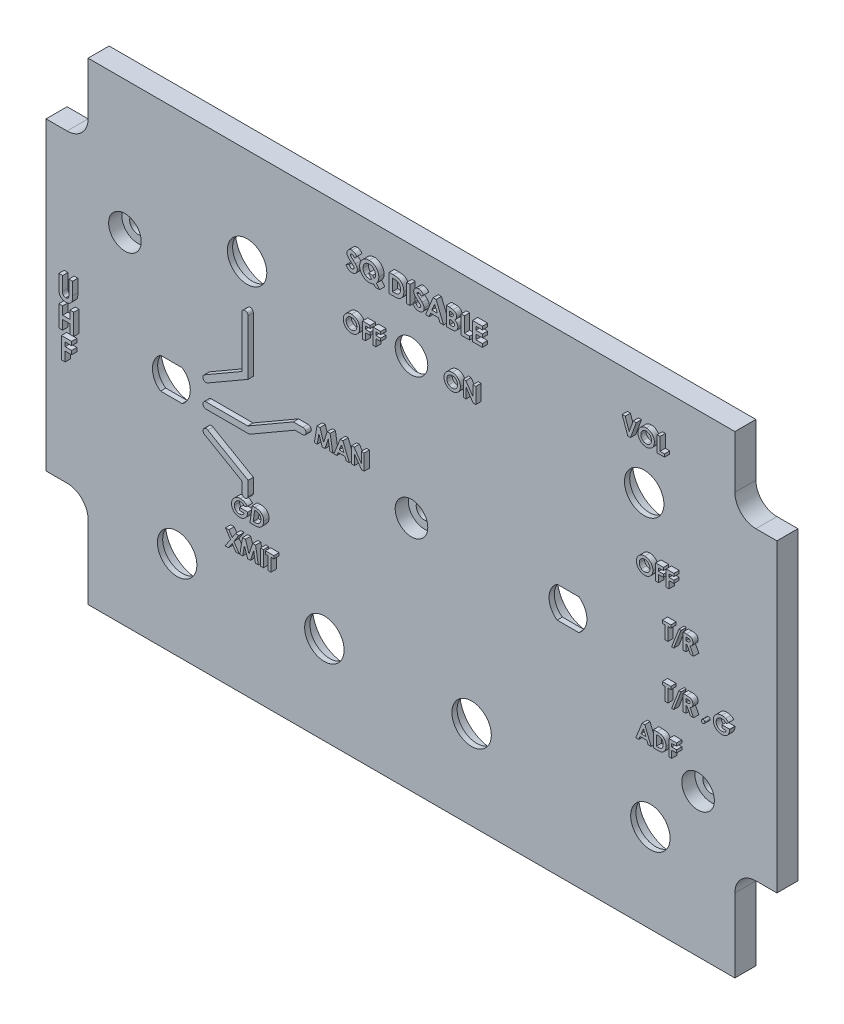
from build123d import *

# Parameters (mm, degrees)
SKETCH1_R            = 3.75
SKETCH1_R_2          = 1.6
SKETCH1_R_3          = 3.1
BOSS_EXTRUDE1_DEPTH  = 4
SKETCH5_R            = 6.7
SKETCH5_R_2          = 6.25
SKETCH5_R_3          = 6
BACK_HOLES_DEPTH     = 3
SKETCH6_R            = 3.1
CAMA_TORNILLOS_DEPTH = 2.5
SKETCH4_W            = 0.538461538
SKETCH4_H            = 3
SKETCH4_W_2          = 0.628205128
SKETCH4_H_2          = 3.5
TEXTOS_DEPTH         = 1


with BuildPart() as part:
    # Sketch1 → Boss-Extrude1 (new body)
    with BuildSketch(Plane.XY):
        with BuildLine():
            Line((8, -0.354637497), (131, -0.354637497))
            Line((131, -0.354637497), (131, 13.645362503))
            ThreePointArc((131, 13.645362503), (132.171572875, 16.473789627), (135, 17.645362503))
            Line((135, 17.645362503), (139, 17.645362503))
            Line((139, 17.645362503), (139, 75.645362503))
            Line((139, 75.645362503), (135, 75.645362503))
            ThreePointArc((135, 75.645362503), (132.171572875, 76.816935378), (131, 79.645362503))
            Line((131, 79.645362503), (131, 89.645362503))
            Line((131, 89.645362503), (8, 89.645362503))
            Line((8, 89.645362503), (8, 79.645362503))
            ThreePointArc((8, 79.645362503), (6.828427125, 76.816935378), (4, 75.645362503))
            Line((4, 75.645362503), (0, 75.645362503))
            Line((0, 75.645362503), (0, 17.645362503))
            Line((0, 17.645362503), (4, 17.645362503))
            ThreePointArc((4, 17.645362503), (6.828427125, 16.473789627), (8, 13.645362503))
            Line((8, 13.645362503), (8, -0.354637497))
        make_face()
        with Locations((113.751643049, 70.92082312)):
            Circle(SKETCH1_R, mode=Mode.SUBTRACT)
        with Locations((124, 26.896787278)):
            Circle(SKETCH1_R_2, mode=Mode.SUBTRACT)
        with Locations((114.931997534, 16.487338536)):
            Circle(SKETCH1_R, mode=Mode.SUBTRACT)
        with Locations((80.931997534, 16.487338536)):
            Circle(SKETCH1_R, mode=Mode.SUBTRACT)
        with Locations((69.5, 71.32082312)):
            Circle(SKETCH1_R_3, mode=Mode.SUBTRACT)
        with Locations((38.235051241, 71.259540461)):
            Circle(SKETCH1_R, mode=Mode.SUBTRACT)
        with Locations((52.931997534, 16.487338536)):
            Circle(SKETCH1_R, mode=Mode.SUBTRACT)
        with Locations((24.931997534, 16.487338536)):
            Circle(SKETCH1_R, mode=Mode.SUBTRACT)
        with Locations((15, 64.459540461)):
            Circle(SKETCH1_R_2, mode=Mode.SUBTRACT)
        with Locations((69.5, 44.645362503)):
            Circle(SKETCH1_R_2, mode=Mode.SUBTRACT)
        with BuildLine():
            Line((21.768626506, 41.695362503), (25.895368563, 41.695362503))
            ThreePointArc((25.895368563, 41.695362503), (27.431997534, 44.645362503), (25.895368563, 47.595362503))
            Line((25.895368563, 47.595362503), (21.768626506, 47.595362503))
            ThreePointArc((21.768626506, 47.595362503), (20.231997534, 44.645362503), (21.768626506, 41.695362503))
        make_face(mode=Mode.SUBTRACT)
        with BuildLine():
            Line((97.198408737, 41.695362503), (101.325150794, 41.695362503))
            ThreePointArc((101.325150794, 41.695362503), (102.861779766, 44.645362503), (101.325150794, 47.595362503))
            Line((101.325150794, 47.595362503), (97.198408737, 47.595362503))
            ThreePointArc((97.198408737, 47.595362503), (95.661779766, 44.645362503), (97.198408737, 41.695362503))
        make_face(mode=Mode.SUBTRACT)
    extrude(amount=BOSS_EXTRUDE1_DEPTH)

    # Sketch5 → Back holes (cut)
    with BuildSketch(Plane(origin=(0, 0, 0), x_dir=(-1, 0, 0), z_dir=(0, 0, -1))):
        with Locations((-69.5, 71.32082312)):
            Circle(SKETCH5_R)
        with Locations((-38.235051241, 71.259540461)):
            Circle(SKETCH5_R_2)
        with Locations((-24.931997534, 16.487338536)):
            Circle(SKETCH5_R_2)
        with Locations((-52.931997534, 16.487338536)):
            Circle(SKETCH5_R_2)
        with Locations((-80.931997534, 16.487338536)):
            Circle(SKETCH5_R_2)
        with Locations((-114.931997534, 16.487338536)):
            Circle(SKETCH5_R_2)
        with Locations((-113.751643049, 70.92082312)):
            Circle(SKETCH5_R_2)
        with Locations((-23.831997534, 44.645362503)):
            Circle(SKETCH5_R_3)
        with Locations((-99.261779766, 44.645362503)):
            Circle(SKETCH5_R_3)
    extrude(amount=-BACK_HOLES_DEPTH, mode=Mode.SUBTRACT)

    # Sketch6 → Cama tornillos (cut)
    with BuildSketch(Plane.XY.offset(4)):
        with Locations((124, 26.896787278)):
            Circle(SKETCH6_R)
        with Locations((15, 64.459540461)):
            Circle(SKETCH6_R)
        with Locations((69.5, 44.645362503)):
            Circle(SKETCH6_R)
    extrude(amount=-CAMA_TORNILLOS_DEPTH, mode=Mode.SUBTRACT)

    # Sketch4 → Textos (add)
    # profile 1 of 46: a face of its own
    with BuildSketch(Plane.XY.offset(4)):
        with BuildLine():
            Line((31.134869532, 49.554497939), (38.229418328, 53.650537596))
            Line((38.229418328, 53.650537596), (38.229418328, 63.418725385))
            ThreePointArc((38.229418328, 63.418725385), (38.829418328, 64.018725385), (39.429418328, 63.418725385))
            Line((39.429418328, 63.418725385), (39.429418328, 52.957717273))
            Line((39.429418328, 52.957717273), (31.734869532, 48.515267455))
            ThreePointArc((31.734869532, 48.515267455), (30.91525429, 48.734882697), (31.134869532, 49.554497939))
        make_face()
    # profile 2 of 46: a face of its own
    with BuildSketch(Plane.XY.offset(4)):
        with BuildLine():
            Line((31.448267614, 44.045362503), (39.681610209, 44.045362503))
            Line((39.681610209, 44.045362503), (48.341864247, 49.045362503))
            Line((48.341864247, 49.045362503), (49.845484743, 49.045362503))
            ThreePointArc((49.845484743, 49.045362503), (50.445484743, 49.645362503), (49.845484743, 50.245362503))
            Line((49.845484743, 50.245362503), (48.020325216, 50.245362503))
            Line((48.020325216, 50.245362503), (39.360071178, 45.245362503))
            Line((39.360071178, 45.245362503), (31.448267614, 45.245362503))
            ThreePointArc((31.448267614, 45.245362503), (30.848267614, 44.645362503), (31.448267614, 44.045362503))
        make_face()
    # profile 3 of 46: a face of its own
    with BuildSketch(Plane.XY.offset(4)):
        with BuildLine():
            Line((31.153117369, 39.725691672), (38.229418328, 35.640187409))
            Line((38.229418328, 35.640187409), (38.229418328, 33.729556795))
            ThreePointArc((38.229418328, 33.729556795), (38.829418328, 33.129556795), (39.429418328, 33.729556795))
            Line((39.429418328, 33.729556795), (39.429418328, 36.333007732))
            Line((39.429418328, 36.333007732), (31.753117369, 40.764922157))
            ThreePointArc((31.753117369, 40.764922157), (30.933502127, 40.545306914), (31.153117369, 39.725691672))
        make_face()
    # profile 4 of 46: a face of its own
    with BuildSketch(Plane.XY.offset(4)):
        with BuildLine():
            Line((3.441028733, 52.426798316), (4.158977451, 52.426798316))
            Line((4.158977451, 52.426798316), (4.158977451, 49.824234214))
            add(Edge.make_bspline(
                [(4.158977451, 49.824234214), (4.159016489, 49.797251958), (4.159091892, 49.74513601), (4.162866579, 49.670366687), (4.166320678, 49.601638024), (4.172552854, 49.539025265), (4.181759913, 49.482501625), (4.190675351, 49.431704017), (4.202741514, 49.387541915), (4.220875029, 49.337273882), (4.248812822, 49.280795), (4.294461625, 49.221931414), (4.34713644, 49.168209848), (4.410270239, 49.123494052), (4.481227045, 49.087323003), (4.559616984, 49.060524259), (4.645329552, 49.045627715), (4.704595091, 49.043353485), (4.735099245, 49.042182932)],
                knots=[0, 0, 0, 0, 1.155499968, 2.231836252, 3.205919964, 4.102923608, 4.924856345, 5.658536265, 6.31071849, 6.882491295, 7.94666036, 8.992281882, 10.060072772, 11.158554251, 12.289267114, 13.461410017, 14.693379945, 16, 16, 16, 16], degree=3))
            add(Edge.make_bspline(
                [(4.735099245, 49.042182932), (4.767506146, 49.043128588), (4.830694114, 49.044972459), (4.921579948, 49.063072045), (5.005786188, 49.091892785), (5.081529901, 49.133027326), (5.148735711, 49.182334283), (5.205624021, 49.238559665), (5.250520066, 49.301815613), (5.279781637, 49.360174043), (5.296210569, 49.413887895), (5.308524872, 49.461879184), (5.317552618, 49.518504154), (5.325742886, 49.582878485), (5.330664606, 49.655668971), (5.336001409, 49.73629022), (5.337957397, 49.825293866), (5.338290781, 49.887268775), (5.33846463, 49.919586778)],
                knots=[0, 0, 0, 0, 1.261321664, 2.459363699, 3.594844139, 4.716940403, 5.803436589, 6.833651888, 7.818396249, 8.814403945, 9.360733334, 10.004355033, 10.743453831, 11.592799886, 12.532235708, 13.585170094, 14.740740724, 16, 16, 16, 16], degree=3))
            Line((5.33846463, 49.919586778), (5.33846463, 52.426798316))
            Line((5.33846463, 52.426798316), (6.056413348, 52.426798316))
            Line((6.056413348, 52.426798316), (6.056413348, 50.040580368))
            add(Edge.make_bspline(
                [(6.056413348, 50.040580368), (6.056313648, 49.992235706), (6.056121934, 49.899273637), (6.053177788, 49.765680601), (6.046910233, 49.643664792), (6.04164621, 49.533190558), (6.031458522, 49.434406724), (6.020845342, 49.346891457), (6.007317931, 49.27095489), (5.987189956, 49.184510337), (5.95245503, 49.084972599), (5.896457776, 48.97035921), (5.825372887, 48.858145759), (5.7413541, 48.749566672), (5.646489204, 48.6487002), (5.542881557, 48.560152493), (5.432177227, 48.485250682), (5.313219432, 48.425826205), (5.186109413, 48.379479593), (5.04958951, 48.348337004), (4.903752819, 48.32729668), (4.80302066, 48.325275498), (4.751124887, 48.324234214)],
                knots=[0, 0, 0, 0, 1.170808336, 2.251350247, 3.235597562, 4.129743112, 4.929140599, 5.639994148, 6.264258765, 6.79612947, 7.788252245, 8.809469599, 9.879094798, 10.999557536, 12.129761673, 13.226370002, 14.293821979, 15.358369427, 16.438775801, 17.562147481, 18.744053101, 20, 20, 20, 20], degree=3))
            add(Edge.make_bspline(
                [(4.751124887, 48.324234214), (4.716644302, 48.324814994), (4.648614816, 48.32596086), (4.548565523, 48.336064413), (4.451848228, 48.35095325), (4.358644661, 48.37267453), (4.268631331, 48.400734367), (4.181832153, 48.435274072), (4.098569692, 48.476100988), (4.019309875, 48.522839594), (3.944150236, 48.57337935), (3.875458206, 48.629404798), (3.810869931, 48.686772644), (3.752251338, 48.747897169), (3.699162151, 48.812136671), (3.651711706, 48.879636738), (3.609970499, 48.950391374), (3.572888552, 49.025675927), (3.541150025, 49.10931684), (3.514393255, 49.204289253), (3.49101791, 49.312081764), (3.473646734, 49.432937226), (3.457897923, 49.56645731), (3.447929794, 49.712989858), (3.442715017, 49.872539074), (3.441605031, 49.983151237), (3.441028733, 50.040580368)],
                knots=[0, 0, 0, 0, 1.001158378, 1.975264943, 2.917723546, 3.841610987, 4.75185031, 5.653588123, 6.552117133, 7.442167995, 8.324307438, 9.179605724, 10.014504199, 10.831958861, 11.636465792, 12.43274043, 13.225645099, 14.020104002, 14.867201867, 15.819789774, 16.883317127, 18.068162734, 19.364263498, 20.787406516, 22.332041935, 24, 24, 24, 24], degree=3))
            Line((3.441028733, 50.040580368), (3.441028733, 52.426798316))
        make_face()
    # profile 5 of 46: a face of its own
    with BuildSketch(Plane.XY.offset(4)):
        with BuildLine():
            add(Edge.make_bspline(
                [(59.092668093, 73.53144292), (59.14482677, 73.530092438), (59.247799812, 73.527426282), (59.399235997, 73.505201787), (59.545172761, 73.468990159), (59.685544113, 73.418653377), (59.819998579, 73.352828064), (59.949010425, 73.273380413), (60.072117536, 73.178810895), (60.188058409, 73.071325663), (60.295208687, 72.954440165), (60.388054465, 72.828592147), (60.467229938, 72.697042456), (60.532850782, 72.559438601), (60.582833269, 72.41482761), (60.617908047, 72.263946808), (60.640441855, 72.106839119), (60.643033589, 71.999870197), (60.644350786, 71.94550542)],
                knots=[0, 0, 0, 0, 1.014329547, 2.002516266, 2.970391464, 3.935626869, 4.897733899, 5.877609409, 6.878433252, 7.912639331, 8.949961323, 9.958554974, 10.949718813, 11.932905612, 12.9188844, 13.919928257, 14.942845884, 16, 16, 16, 16], degree=3))
            add(Edge.make_bspline(
                [(60.644350786, 71.94550542), (60.642948029, 71.891753208), (60.640183851, 71.785832751), (60.618827976, 71.630172871), (60.583162534, 71.480908317), (60.534027789, 71.337701224), (60.469597059, 71.20124524), (60.391965594, 71.07066911), (60.299084846, 70.947184614), (60.194342543, 70.830858017), (60.079030356, 70.72526667), (59.956896445, 70.632214478), (59.828504748, 70.553365561), (59.69404319, 70.488756037), (59.553223424, 70.438614966), (59.406393293, 70.403236796), (59.253561882, 70.381736768), (59.149629111, 70.378990645), (59.096874824, 70.377596766)],
                knots=[0, 0, 0, 0, 1.051557043, 2.072126891, 3.067553643, 4.050577992, 5.02905126, 6.015227836, 7.017913613, 8.04756643, 9.074058332, 10.072836633, 11.047628519, 12.017157415, 12.98668631, 13.966869689, 14.968021931, 16, 16, 16, 16], degree=3))
            add(Edge.make_bspline(
                [(59.096874824, 70.377596766), (59.041700165, 70.378847145), (58.933289503, 70.381303967), (58.774630012, 70.404667229), (58.622620511, 70.439860464), (58.478537966, 70.492384478), (58.340915021, 70.558043913), (58.210762831, 70.638907443), (58.088125135, 70.734841435), (57.973705405, 70.843388985), (57.870040852, 70.962163813), (57.77853655, 71.087638885), (57.701350642, 71.218855683), (57.638480302, 71.355875619), (57.588915853, 71.497847148), (57.553953765, 71.645634916), (57.533300825, 71.798884476), (57.530423991, 71.902974641), (57.52896617, 71.955721766)],
                knots=[0, 0, 0, 0, 1.067978421, 2.098431617, 3.099715153, 4.085208694, 5.062210972, 6.048429807, 7.046490867, 8.072918869, 9.098532598, 10.095778865, 11.076610158, 12.041847152, 13.011192615, 13.984257998, 14.978533688, 16, 16, 16, 16], degree=3))
            add(Edge.make_bspline(
                [(57.52896617, 71.955721766), (57.529423718, 71.991207271), (57.530333021, 72.061728952), (57.541286526, 72.166238485), (57.557056423, 72.268708131), (57.580379354, 72.368729344), (57.608710754, 72.467007726), (57.645418084, 72.562628478), (57.68720096, 72.656613093), (57.736020316, 72.747851494), (57.79030272, 72.835504212), (57.849529656, 72.919157774), (57.913850048, 72.997800686), (57.983056701, 73.071949757), (58.057388108, 73.141117599), (58.135866518, 73.20628338), (58.220013954, 73.265716064), (58.307988693, 73.320867117), (58.399294755, 73.370739258), (58.493560439, 73.413188933), (58.588843687, 73.450259511), (58.686417356, 73.47951725), (58.785235768, 73.503347373), (58.886354599, 73.519106642), (58.988860298, 73.530059843), (59.057983376, 73.5309808), (59.092668093, 73.53144292)],
                knots=[0, 0, 0, 0, 1.034744296, 2.056386356, 3.06226378, 4.057406941, 5.050368692, 6.043467995, 7.042652155, 8.049140477, 9.059438543, 10.048523776, 11.036952808, 12.020949711, 13.004946614, 13.997082645, 14.994316842, 16.007702937, 17.024872941, 18.026463647, 19.021641123, 20.005082605, 20.995858141, 21.984425357, 22.988620895, 24, 24, 24, 24], degree=3))
        make_face()
        with BuildLine():
            add(Edge.make_bspline(
                [(59.084254632, 72.992981381), (59.049151849, 72.992039495), (58.979873004, 72.990180588), (58.878253554, 72.976018231), (58.780695293, 72.953399337), (58.687739025, 72.920636146), (58.598981871, 72.878936919), (58.51426649, 72.828447358), (58.434766016, 72.767431941), (58.359420387, 72.699166313), (58.291358009, 72.623102716), (58.231222751, 72.541587636), (58.180899226, 72.454757201), (58.138752958, 72.363418047), (58.10702616, 72.266543087), (58.084428112, 72.164891155), (58.07014699, 72.058287099), (58.068346837, 71.985615252), (58.067427709, 71.948510228)],
                knots=[0, 0, 0, 0, 1.033739768, 2.040188636, 3.016340934, 3.979330865, 4.937572243, 5.900995986, 6.878200029, 7.884839167, 8.891893314, 9.879764717, 10.863503415, 11.843163062, 12.837761627, 13.859916423, 14.907309254, 16, 16, 16, 16], degree=3))
            add(Edge.make_bspline(
                [(58.067427709, 71.948510228), (58.068646332, 71.907389514), (58.071034632, 71.826799727), (58.087839001, 71.709237519), (58.116589604, 71.598211681), (58.158104916, 71.494265224), (58.209594794, 71.396243901), (58.27353705, 71.305349103), (58.348896124, 71.221036593), (58.406952143, 71.171811439), (58.436418093, 71.146827535)],
                knots=[0, 0, 0, 0, 1.078454662, 2.113592447, 3.107694534, 4.079536787, 5.043276885, 6.005368276, 6.987637804, 8, 8, 8, 8], degree=3))
            add(Edge.make_bspline(
                [(58.436418093, 71.146827535), (58.460556332, 71.128370387), (58.508288971, 71.091871934), (58.584480655, 71.045091678), (58.662943086, 71.004996332), (58.744268363, 70.972599767), (58.82828473, 70.947117174), (58.914980666, 70.929272133), (59.00423333, 70.918072826), (59.064590164, 70.916734297), (59.09507194, 70.916058305)],
                knots=[0, 0, 0, 0, 1.023928204, 2.024787132, 3.009472467, 3.9914905, 4.972207045, 5.96565515, 6.972602802, 8, 8, 8, 8], degree=3))
            add(Edge.make_bspline(
                [(59.09507194, 70.916058305), (59.129571129, 70.917008177), (59.197449369, 70.918877081), (59.297177118, 70.932865092), (59.392719331, 70.956537856), (59.484669141, 70.989013637), (59.572761407, 71.031236435), (59.656565597, 71.083292023), (59.736228643, 71.144541228), (59.811478283, 71.213703333), (59.880260011, 71.290066568), (59.94026978, 71.372016441), (59.992193341, 71.457747352), (60.033463176, 71.54847269), (60.066443429, 71.643336053), (60.088769497, 71.742757568), (60.103171263, 71.846327383), (60.104971923, 71.916810302), (60.105889247, 71.952716958)],
                knots=[0, 0, 0, 0, 1.026359118, 2.019393844, 2.989460624, 3.950973911, 4.916101784, 5.890408035, 6.881132271, 7.902007068, 8.92769091, 9.933912415, 10.920395702, 11.90457117, 12.894218921, 13.903490204, 14.931958862, 16, 16, 16, 16], degree=3))
            add(Edge.make_bspline(
                [(60.105889247, 71.952716958), (60.104940183, 71.988417142), (60.103072096, 72.058687508), (60.089059466, 72.161991046), (60.065536828, 72.260973644), (60.032963525, 72.355796952), (59.991369143, 72.446553932), (59.93993347, 72.532925429), (59.878836987, 72.614827942), (59.809485826, 72.691703337), (59.73400135, 72.762346901), (59.652961222, 72.823652673), (59.568633037, 72.87692544), (59.479081894, 72.918657174), (59.386139935, 72.951904758), (59.289240024, 72.976388756), (59.188015144, 72.990081097), (59.119149766, 72.992006002), (59.084254632, 72.992981381)],
                knots=[0, 0, 0, 0, 1.055025985, 2.07665775, 3.074803781, 4.057872707, 5.035505728, 6.020516407, 7.023567878, 8.050795229, 9.077271434, 10.074415901, 11.050397877, 12.019801805, 12.988065821, 13.964604439, 14.968634123, 16, 16, 16, 16], degree=3))
        make_face(mode=Mode.SUBTRACT)
    # profile 6 of 46: a face of its own
    with BuildSketch(Plane.XY.offset(4)):
        Polygon((61.182812324, 73.454519843), (62.644350786, 73.454519843), (62.644350786, 72.916058305), (61.721273863, 72.916058305), (61.721273863, 72.339135228), (62.644350786, 72.339135228), (62.644350786, 71.800673689), (61.721273863, 71.800673689), (61.721273863, 70.454519843), (61.182812324, 70.454519843), align=None)
    # profile 7 of 46: a face of its own
    with BuildSketch(Plane.XY.offset(4)):
        Polygon((63.182812324, 73.454519843), (64.644350786, 73.454519843), (64.644350786, 72.916058305), (63.721273863, 72.916058305), (63.721273863, 72.339135228), (64.644350786, 72.339135228), (64.644350786, 71.800673689), (63.721273863, 71.800673689), (63.721273863, 70.454519843), (63.182812324, 70.454519843), align=None)
    # profile 8 of 46: a face of its own
    with BuildSketch(Plane.XY.offset(4)):
        with BuildLine():
            Line((39.270530127, 31.97178632), (38.792765704, 31.672507473))
            add(Edge.make_bspline(
                [(38.792765704, 31.672507473), (38.758880359, 31.709521766), (38.69414703, 31.780232524), (38.592612537, 31.872685726), (38.492592881, 31.947141601), (38.392538883, 32.003823868), (38.290173527, 32.045917317), (38.182637115, 32.07423764), (38.068810266, 32.092247387), (37.990752244, 32.094455003), (37.950818588, 32.095584397)],
                knots=[0, 0, 0, 0, 1.232977487, 2.355435308, 3.369770187, 4.291348691, 5.174604885, 6.082334442, 7.018942652, 8, 8, 8, 8], degree=3))
            add(Edge.make_bspline(
                [(37.950818588, 32.095584397), (37.907458979, 32.094435104), (37.822241937, 32.092176337), (37.697952713, 32.07080171), (37.579528587, 32.038110892), (37.467476271, 31.990760271), (37.361728056, 31.929490617), (37.262157063, 31.855062814), (37.168693668, 31.767404671), (37.113569561, 31.700596861), (37.085433973, 31.666497858)],
                knots=[0, 0, 0, 0, 1.037106879, 2.038283569, 3.009830787, 3.972569298, 4.94146214, 5.928319872, 6.942605276, 8, 8, 8, 8], degree=3))
            add(Edge.make_bspline(
                [(37.085433973, 31.666497858), (37.064298271, 31.637993346), (37.022545696, 31.581684039), (36.969250186, 31.492070847), (36.923325355, 31.400815361), (36.885677534, 31.307004364), (36.856871082, 31.210821601), (36.836526, 31.112077525), (36.823374891, 31.011203196), (36.821801722, 30.942980596), (36.821010896, 30.908685358)],
                knots=[0, 0, 0, 0, 1.040960542, 2.056368018, 3.055559505, 4.03710588, 5.019268411, 5.998275661, 6.99374091, 8, 8, 8, 8], degree=3))
            add(Edge.make_bspline(
                [(36.821010896, 30.908685358), (36.821820133, 30.875197202), (36.82341545, 30.809179143), (36.835983632, 30.712266474), (36.858131036, 30.619715121), (36.887171721, 30.53082194), (36.926061018, 30.446392586), (36.973132904, 30.366047131), (37.028773, 30.290003223), (37.092288177, 30.218894667), (37.161784849, 30.153972214), (37.23598193, 30.097068433), (37.314155648, 30.049171933), (37.39633735, 30.009951407), (37.482475886, 29.979081224), (37.572782459, 29.957672811), (37.666739238, 29.943897609), (37.730817634, 29.942464914), (37.763318588, 29.941738243)],
                knots=[0, 0, 0, 0, 1.066897471, 2.103265977, 3.106535126, 4.095591644, 5.078159493, 6.062322472, 7.058152725, 8.075375883, 9.096057735, 10.084186963, 11.049730852, 12.011871914, 12.980953841, 13.959387168, 14.96498868, 16, 16, 16, 16], degree=3))
            add(Edge.make_bspline(
                [(37.763318588, 29.941738243), (37.787775403, 29.942191365), (37.836195741, 29.94308847), (37.907890803, 29.950510741), (37.977958806, 29.962566361), (38.04630657, 29.979226252), (38.112926861, 30.001131855), (38.177960146, 30.027684542), (38.241585762, 30.058710193), (38.303094859, 30.09512261), (38.362585976, 30.135750818), (38.41921809, 30.18161164), (38.472864259, 30.232420831), (38.523954527, 30.287910801), (38.57282259, 30.347785676), (38.617725724, 30.413296392), (38.660669125, 30.482997324), (38.686480695, 30.532122286), (38.699616665, 30.557122858)],
                knots=[0, 0, 0, 0, 0.990751711, 1.961520103, 2.916931976, 3.869720035, 4.809138875, 5.755683625, 6.713987145, 7.674487982, 8.649319602, 9.630449541, 10.623757948, 11.640402946, 12.684918653, 13.752145235, 14.856026455, 16, 16, 16, 16], degree=3))
            Line((38.699616665, 30.557122858), (37.752501281, 30.557122858))
            Line((37.752501281, 30.557122858), (37.821010896, 31.057122858))
            Line((37.821010896, 31.057122858), (39.359472435, 31.057122858))
            add(Edge.make_bspline(
                [(39.359472435, 31.057122858), (39.35562422, 30.996732825), (39.348098878, 30.878637621), (39.320865277, 30.706676941), (39.280531227, 30.544505786), (39.228248937, 30.391499319), (39.16349056, 30.247942922), (39.085249657, 30.114225698), (38.99505926, 29.989844898), (38.892100055, 29.876431062), (38.779359312, 29.774666382), (38.658944757, 29.684760076), (38.529942111, 29.610184248), (38.394071041, 29.548580129), (38.250796792, 29.50012773), (38.099755094, 29.466159416), (37.941192987, 29.445221521), (37.832895528, 29.442913616), (37.777741665, 29.441738243)],
                knots=[0, 0, 0, 0, 1.148955532, 2.246830018, 3.301660101, 4.319666133, 5.314146826, 6.287838685, 7.257462643, 8.227280698, 9.191724348, 10.138440807, 11.076252923, 12.016254752, 12.968042649, 13.943717582, 14.952773983, 16, 16, 16, 16], degree=3))
            add(Edge.make_bspline(
                [(37.777741665, 29.441738243), (37.747483906, 29.442038278), (37.687707665, 29.442631018), (37.599441726, 29.448720137), (37.513655959, 29.459115942), (37.430404271, 29.472770977), (37.349319617, 29.490224094), (37.270818883, 29.511716728), (37.194719912, 29.537551917), (37.121498825, 29.568161817), (37.049596485, 29.600458487), (36.981244585, 29.638932866), (36.914762684, 29.680230128), (36.851196093, 29.726135042), (36.789586615, 29.775427555), (36.73086754, 29.828896298), (36.674525066, 29.886329453), (36.639304157, 29.927119069), (36.621491665, 29.947747858)],
                knots=[0, 0, 0, 0, 1.111499042, 2.195841241, 3.24834816, 4.285223882, 5.294222847, 6.294054786, 7.273859608, 8.244193736, 9.208986092, 10.167555097, 11.123181443, 12.083077344, 13.046240314, 14.020501641, 14.998895854, 16, 16, 16, 16], degree=3))
            add(Edge.make_bspline(
                [(36.621491665, 29.947747858), (36.594415624, 29.981943067), (36.540657223, 30.049836291), (36.471645688, 30.159231538), (36.412752793, 30.273319484), (36.365590557, 30.392683031), (36.327886444, 30.516400945), (36.301566519, 30.645153118), (36.285731871, 30.778679968), (36.283619, 30.869379314), (36.282549358, 30.915295935)],
                knots=[0, 0, 0, 0, 0.999328569, 1.984127054, 2.959716786, 3.938705326, 4.922250225, 5.921072174, 6.947541011, 8, 8, 8, 8], degree=3))
            add(Edge.make_bspline(
                [(36.282549358, 30.915295935), (36.283986129, 30.971474382), (36.28682123, 31.082328217), (36.311266763, 31.245309341), (36.349290665, 31.402799351), (36.404616999, 31.55400957), (36.474458237, 31.699798118), (36.560737722, 31.839046383), (36.66136566, 31.97330354), (36.777220767, 32.09891462), (36.902860473, 32.215003638), (37.036270152, 32.316976157), (37.176163171, 32.402809271), (37.321398174, 32.473889247), (37.473361491, 32.527934036), (37.630717465, 32.567048215), (37.794217716, 32.591286316), (37.90526213, 32.594137128), (37.961635896, 32.595584397)],
                knots=[0, 0, 0, 0, 1.022519879, 2.01768214, 2.99445506, 3.968403767, 4.944092992, 5.933246428, 6.946641619, 7.994936793, 9.040543676, 10.058341478, 11.047494914, 12.024771785, 12.997483176, 13.978673844, 14.973836105, 16, 16, 16, 16], degree=3))
            add(Edge.make_bspline(
                [(37.961635896, 32.595584397), (38.003946488, 32.594898712), (38.088197244, 32.593533347), (38.213432367, 32.578744122), (38.337305985, 32.557009807), (38.458618268, 32.524825215), (38.576572325, 32.485572754), (38.689566135, 32.438582772), (38.796509607, 32.384004448), (38.898195109, 32.32129266), (38.995632326, 32.249727608), (39.090663088, 32.167979941), (39.182989913, 32.074868823), (39.240929734, 32.006642102), (39.270530127, 31.97178632)],
                knots=[0, 0, 0, 0, 1.014010841, 2.019144067, 3.019687909, 4.027399918, 5.025300219, 5.998481464, 6.958680332, 7.901091373, 8.859847597, 9.854378501, 10.903841272, 12, 12, 12, 12], degree=3))
        make_face()
    # profile 9 of 46: a face of its own
    with BuildSketch(Plane.XY.offset(4)):
        with BuildLine():
            Line((40.203222435, 32.51866132), (40.676780127, 32.51866132))
            add(Edge.make_bspline(
                [(40.676780127, 32.51866132), (40.730473536, 32.518217859), (40.834306163, 32.517360293), (40.98488169, 32.510289443), (41.124628865, 32.497809155), (41.253803393, 32.480535569), (41.372415778, 32.458497543), (41.48051132, 32.431812271), (41.578197755, 32.400242735), (41.665747285, 32.362311083), (41.746359652, 32.31974631), (41.821904509, 32.271177849), (41.893682997, 32.21721227), (41.962179157, 32.158191034), (42.026004548, 32.092817715), (42.086057364, 32.021781383), (42.142567468, 31.945236028), (42.195344218, 31.8639763), (42.242817385, 31.778059355), (42.284288859, 31.688259096), (42.319894676, 31.595427162), (42.348056868, 31.499053957), (42.370319922, 31.399685929), (42.38650383, 31.296935715), (42.396383045, 31.190932097), (42.39741283, 31.119243577), (42.397933973, 31.082964204)],
                knots=[0, 0, 0, 0, 1.508928034, 2.917973822, 4.235011166, 5.450779055, 6.579221784, 7.623755204, 8.577985451, 9.460610614, 10.301756591, 11.137250569, 11.981705789, 12.823774396, 13.675702816, 14.546470419, 15.435981066, 16.347923198, 17.267651715, 18.192054867, 19.125737078, 20.059147693, 21.011116727, 21.985721956, 22.980635317, 24, 24, 24, 24], degree=3))
            add(Edge.make_bspline(
                [(42.397933973, 31.082964204), (42.397201734, 31.045481793), (42.395746306, 30.970980268), (42.385302977, 30.860578384), (42.368414019, 30.752412279), (42.345134372, 30.646519543), (42.314474292, 30.542857937), (42.276191845, 30.441973634), (42.232602037, 30.342857574), (42.181378381, 30.247548158), (42.126136884, 30.15603644), (42.06632803, 30.070469389), (42.003598354, 29.990939357), (41.936370517, 29.918537408), (41.865935871, 29.852231782), (41.792268261, 29.79202401), (41.714572972, 29.738749259), (41.632937401, 29.691461059), (41.545188123, 29.650009097), (41.449981791, 29.614893323), (41.347025807, 29.584712086), (41.235827387, 29.561150408), (41.116916984, 29.541915737), (40.989955489, 29.528139016), (40.85495735, 29.520597108), (40.762326059, 29.51931918), (40.714640704, 29.51866132)],
                knots=[0, 0, 0, 0, 1.035326767, 2.057856534, 3.060426681, 4.057975219, 5.050723532, 6.043595218, 7.036960241, 8.039530388, 9.030318104, 9.988216712, 10.921569661, 11.826132526, 12.714780289, 13.59198308, 14.451536877, 15.31430869, 16.195534129, 17.128821459, 18.114698389, 19.15667332, 20.266554844, 21.441073174, 22.682698532, 24, 24, 24, 24], degree=3))
            Line((40.714640704, 29.51866132), (39.782549358, 29.51866132))
            Line((39.782549358, 29.51866132), (40.203222435, 32.51866132))
        make_face()
        with BuildLine():
            Line((40.676780127, 32.01866132), (40.39673205, 30.01866132))
            Line((40.39673205, 30.01866132), (40.590241665, 30.01866132))
            add(Edge.make_bspline(
                [(40.590241665, 30.01866132), (40.626304377, 30.018846024), (40.695644585, 30.019201168), (40.795808707, 30.023176994), (40.888272774, 30.027910093), (40.972988965, 30.036698844), (41.050266824, 30.046478341), (41.119581401, 30.059219268), (41.181729931, 30.072914042), (41.219541533, 30.085844935), (41.237477242, 30.091978627)],
                knots=[0, 0, 0, 0, 1.323091274, 2.54399687, 3.677836413, 4.719289959, 5.668358043, 6.534823038, 7.305002022, 8, 8, 8, 8], degree=3))
            add(Edge.make_bspline(
                [(41.237477242, 30.091978627), (41.260522566, 30.100935565), (41.306304225, 30.118729346), (41.370869004, 30.153341778), (41.433513109, 30.19002685), (41.491497243, 30.233177097), (41.546876799, 30.280017714), (41.597436325, 30.332549925), (41.645630379, 30.388841579), (41.689750886, 30.449976897), (41.73008565, 30.514975304), (41.764434587, 30.584345178), (41.794094051, 30.657164764), (41.81784372, 30.734035842), (41.836661432, 30.814351476), (41.84951737, 30.898350129), (41.858492857, 30.986014972), (41.85914201, 31.045881149), (41.859472435, 31.076353627)],
                knots=[0, 0, 0, 0, 0.952655881, 1.892538673, 2.821337892, 3.750040712, 4.676008024, 5.615700279, 6.558436491, 7.532008524, 8.520486916, 9.505184105, 10.513747313, 11.549809891, 12.604882282, 13.692134403, 14.825273528, 16, 16, 16, 16], degree=3))
            add(Edge.make_bspline(
                [(41.859472435, 31.076353627), (41.859127143, 31.101401738), (41.858452289, 31.150356868), (41.853149515, 31.222237478), (41.843320969, 31.291013511), (41.830457273, 31.356723378), (41.81336047, 31.419309788), (41.792987257, 31.47875925), (41.769253953, 31.535503684), (41.731265918, 31.605491789), (41.677147679, 31.687182928), (41.598055487, 31.773249079), (41.506683179, 31.84739877), (41.421036057, 31.898710259), (41.346284606, 31.933986545), (41.284877888, 31.956558583), (41.219045361, 31.975939696), (41.148667611, 31.991115869), (41.074160896, 32.004155138), (40.99501539, 32.011973148), (40.91144135, 32.017763913), (40.854075115, 32.018356842), (40.824616665, 32.01866132)],
                knots=[0, 0, 0, 0, 0.94164902, 1.840400246, 2.70735158, 3.552169971, 4.356016339, 5.144331422, 5.913676253, 6.665006732, 8.135486087, 9.585359709, 11.041478777, 12.544856699, 13.326488422, 14.146229178, 15.001754778, 15.904378661, 16.85152277, 17.843704754, 18.892709022, 20, 20, 20, 20], degree=3))
            Line((40.824616665, 32.01866132), (40.676780127, 32.01866132))
        make_face(mode=Mode.SUBTRACT)
    # profile 10 of 46: a face of its own
    with BuildSketch(Plane.XY.offset(4)):
        Polygon((35.137717627, 26.364815166), (35.772333012, 26.364815166), (36.399135896, 25.40147382), (37.027140704, 26.364815166), (37.663558973, 26.364815166), (36.71704455, 24.91349305), (37.72485705, 23.364815166), (37.090241665, 23.364815166), (36.399135896, 24.426714204), (35.706828204, 23.364815166), (35.071010896, 23.364815166), (36.081828204, 24.914694973), align=None)
    # profile 11 of 46: a face of its own
    with BuildSketch(Plane.XY.offset(4)):
        Polygon((38.366083012, 26.364815166), (38.923775319, 26.364815166), (39.609472435, 24.272267089), (40.298775319, 26.364815166), (40.852260896, 26.364815166), (41.359472435, 23.364815166), (40.814400319, 23.364815166), (40.494087819, 25.259646897), (39.870289742, 23.364815166), (39.345650319, 23.364815166), (38.72485705, 25.259646897), (38.405145512, 23.364815166), (37.859472435, 23.364815166), align=None)
    # profile 12 of 46: a face of its own
    with BuildSketch(Plane.XY.offset(4)):
        with Locations((42.051780127, 24.864815166)):
            Rectangle(SKETCH4_W, SKETCH4_H)
    # profile 13 of 46: a face of its own
    with BuildSketch(Plane.XY.offset(4)):
        Polygon((42.705626281, 26.364815166), (44.321010896, 26.364815166), (44.321010896, 25.826353627), (43.782549358, 25.826353627), (43.782549358, 23.364815166), (43.244087819, 23.364815166), (43.244087819, 25.826353627), (42.705626281, 25.826353627), align=None)
    # profile 14 of 46: a face of its own
    with BuildSketch(Plane.XY.offset(4)):
        Polygon((52.537498091, 51.857148765), (53.095190398, 51.857148765), (53.780887514, 49.764600688), (54.470190398, 51.857148765), (55.023675975, 51.857148765), (55.530887514, 48.857148765), (54.985815398, 48.857148765), (54.665502898, 50.751980496), (54.041704822, 48.857148765), (53.517065398, 48.857148765), (52.896272129, 50.751980496), (52.576560591, 48.857148765), (52.030887514, 48.857148765), align=None)
    # profile 15 of 46: a face of its own
    with BuildSketch(Plane.XY.offset(4)):
        Polygon((56.953363475, 51.857148765), (57.453964437, 51.857148765), (58.665502898, 48.857148765), (58.090382706, 48.857148765), (57.857209629, 49.472533381), (56.551320206, 49.472533381), (56.317546168, 48.857148765), (55.742425975, 48.857148765), align=None)
        Polygon((57.203964437, 51.052461265), (56.755647129, 50.010994919), (57.652882706, 50.010994919), align=None, mode=Mode.SUBTRACT)
    # profile 16 of 46: a face of its own
    with BuildSketch(Plane.XY.offset(4)):
        Polygon((59.107810591, 51.857148765), (59.592786552, 51.857148765), (60.953964437, 49.882990112), (60.953964437, 51.857148765), (61.492425975, 51.857148765), (61.492425975, 48.857148765), (61.003844245, 48.857148765), (59.646272129, 50.825297804), (59.646272129, 48.857148765), (59.107810591, 48.857148765), align=None)
    # profile 17 of 46: a face of its own
    with BuildSketch(Plane.XY.offset(4)):
        Polygon((110.554646887, 82.735745457), (111.129767079, 82.735745457), (111.900800733, 80.604735842), (112.672435349, 82.735745457), (113.246954579, 82.735745457), (112.159815156, 79.735745457), (111.640584387, 79.735745457), align=None)
    # profile 18 of 46: a face of its own
    with BuildSketch(Plane.XY.offset(4)):
        with BuildLine():
            add(Edge.make_bspline(
                [(115.137579579, 82.812668534), (115.189738256, 82.811318053), (115.292711298, 82.808651896), (115.444147482, 82.786427401), (115.590084247, 82.750215773), (115.730455599, 82.699878991), (115.864910065, 82.634053679), (115.993921911, 82.554606027), (116.117029022, 82.46003651), (116.232969895, 82.352551277), (116.340120173, 82.23566578), (116.432965951, 82.109817761), (116.512141424, 81.97826807), (116.577762268, 81.840664216), (116.627744755, 81.696053225), (116.662819533, 81.545172423), (116.685353341, 81.388064733), (116.687945075, 81.281095811), (116.689262272, 81.226731034)],
                knots=[0, 0, 0, 0, 1.014329547, 2.002516266, 2.970391464, 3.935626869, 4.897733899, 5.877609409, 6.878433252, 7.912639331, 8.949961323, 9.958554974, 10.949718813, 11.932905612, 12.9188844, 13.919928257, 14.942845884, 16, 16, 16, 16], degree=3))
            add(Edge.make_bspline(
                [(116.689262272, 81.226731034), (116.687859515, 81.172978823), (116.685095337, 81.067058365), (116.663739462, 80.911398485), (116.62807402, 80.762133931), (116.578939275, 80.618926838), (116.514508545, 80.482470854), (116.43687708, 80.351894724), (116.343996332, 80.228410228), (116.239254028, 80.112083632), (116.123941842, 80.006492284), (116.001807931, 79.913440092), (115.873416234, 79.834591175), (115.738954676, 79.769981652), (115.59813491, 79.71984058), (115.451304779, 79.68446241), (115.298473368, 79.662962382), (115.194540597, 79.66021626), (115.14178631, 79.65882238)],
                knots=[0, 0, 0, 0, 1.051557043, 2.072126891, 3.067553643, 4.050577992, 5.02905126, 6.015227836, 7.017913613, 8.04756643, 9.074058332, 10.072836633, 11.047628519, 12.017157415, 12.98668631, 13.966869689, 14.968021931, 16, 16, 16, 16], degree=3))
            add(Edge.make_bspline(
                [(115.14178631, 79.65882238), (115.086611651, 79.660072759), (114.978200988, 79.662529581), (114.819541498, 79.685892844), (114.667531997, 79.721086078), (114.523449452, 79.773610092), (114.385826507, 79.839269527), (114.255674317, 79.920133057), (114.133036621, 80.01606705), (114.018616891, 80.124614599), (113.914952338, 80.243389427), (113.823448036, 80.368864499), (113.746262128, 80.500081298), (113.683391788, 80.637101234), (113.633827339, 80.779072762), (113.598865251, 80.926860531), (113.578212311, 81.08011009), (113.575335477, 81.184200255), (113.573877656, 81.23694738)],
                knots=[0, 0, 0, 0, 1.067978421, 2.098431617, 3.099715153, 4.085208694, 5.062210972, 6.048429807, 7.046490867, 8.072918869, 9.098532598, 10.095778865, 11.076610158, 12.041847152, 13.011192615, 13.984257998, 14.978533688, 16, 16, 16, 16], degree=3))
            add(Edge.make_bspline(
                [(113.573877656, 81.23694738), (113.574335204, 81.272432885), (113.575244507, 81.342954567), (113.586198012, 81.447464099), (113.601967909, 81.549933745), (113.62529084, 81.649954958), (113.65362224, 81.74823334), (113.69032957, 81.843854093), (113.732112446, 81.937838707), (113.780931802, 82.029077108), (113.835214206, 82.116729826), (113.894441142, 82.200383388), (113.958761534, 82.2790263), (114.027968187, 82.353175371), (114.102299594, 82.422343213), (114.180778004, 82.487508994), (114.26492544, 82.546941678), (114.352900179, 82.602092732), (114.44420624, 82.651964873), (114.538471925, 82.694414547), (114.633755173, 82.731485125), (114.731328842, 82.760742865), (114.830147254, 82.784572987), (114.931266085, 82.800332256), (115.033771784, 82.811285458), (115.102894862, 82.812206415), (115.137579579, 82.812668534)],
                knots=[0, 0, 0, 0, 1.034744296, 2.056386356, 3.06226378, 4.057406941, 5.050368692, 6.043467995, 7.042652155, 8.049140477, 9.059438543, 10.048523776, 11.036952808, 12.020949711, 13.004946614, 13.997082645, 14.994316842, 16.007702937, 17.024872941, 18.026463647, 19.021641123, 20.005082605, 20.995858141, 21.984425357, 22.988620895, 24, 24, 24, 24], degree=3))
        make_face()
        with BuildLine():
            add(Edge.make_bspline(
                [(115.129166118, 82.274206996), (115.094063335, 82.273265109), (115.024784489, 82.271406202), (114.923165039, 82.257243845), (114.825606779, 82.234624951), (114.732650511, 82.20186176), (114.643893357, 82.160162533), (114.559177976, 82.109672972), (114.479677502, 82.048657555), (114.404331872, 81.980391928), (114.336269495, 81.90432833), (114.276134237, 81.82281325), (114.225810712, 81.735982816), (114.183664444, 81.644643661), (114.151937646, 81.547768701), (114.129339598, 81.446116769), (114.115058476, 81.339512713), (114.113258323, 81.266840867), (114.112339195, 81.229735842)],
                knots=[0, 0, 0, 0, 1.033739768, 2.040188636, 3.016340934, 3.979330865, 4.937572243, 5.900995986, 6.878200029, 7.884839167, 8.891893314, 9.879764717, 10.863503415, 11.843163062, 12.837761627, 13.859916423, 14.907309254, 16, 16, 16, 16], degree=3))
            add(Edge.make_bspline(
                [(114.112339195, 81.229735842), (114.113557818, 81.188615128), (114.115946118, 81.108025342), (114.132750487, 80.990463133), (114.16150109, 80.879437295), (114.203016402, 80.775490838), (114.25450628, 80.677469515), (114.318448536, 80.586574717), (114.39380761, 80.502262208), (114.451863629, 80.453037053), (114.481329579, 80.42805315)],
                knots=[0, 0, 0, 0, 1.078454662, 2.113592447, 3.107694534, 4.079536787, 5.043276885, 6.005368276, 6.987637804, 8, 8, 8, 8], degree=3))
            add(Edge.make_bspline(
                [(114.481329579, 80.42805315), (114.505467818, 80.409596001), (114.553200457, 80.373097548), (114.629392141, 80.326317292), (114.707854572, 80.286221947), (114.789179849, 80.253825382), (114.873196216, 80.228342788), (114.959892152, 80.210497747), (115.049144816, 80.19929844), (115.10950165, 80.197959911), (115.139983425, 80.197283919)],
                knots=[0, 0, 0, 0, 1.023928204, 2.024787132, 3.009472467, 3.9914905, 4.972207045, 5.96565515, 6.972602802, 8, 8, 8, 8], degree=3))
            add(Edge.make_bspline(
                [(115.139983425, 80.197283919), (115.174482615, 80.198233791), (115.242360855, 80.200102696), (115.342088604, 80.214090706), (115.437630816, 80.237763471), (115.529580627, 80.270239252), (115.617672892, 80.312462049), (115.701477083, 80.364517638), (115.781140129, 80.425766842), (115.856389769, 80.494928947), (115.925171497, 80.571292182), (115.985181265, 80.653242055), (116.037104827, 80.738972966), (116.078374662, 80.829698305), (116.111354915, 80.924561667), (116.133680983, 81.023983182), (116.148082748, 81.127552997), (116.149883409, 81.198035916), (116.150800733, 81.233942573)],
                knots=[0, 0, 0, 0, 1.026359118, 2.019393844, 2.989460624, 3.950973911, 4.916101784, 5.890408035, 6.881132271, 7.902007068, 8.92769091, 9.933912415, 10.920395702, 11.90457117, 12.894218921, 13.903490204, 14.931958862, 16, 16, 16, 16], degree=3))
            add(Edge.make_bspline(
                [(116.150800733, 81.233942573), (116.149851669, 81.269642756), (116.147983582, 81.339913122), (116.133970952, 81.44321666), (116.110448314, 81.542199258), (116.077875011, 81.637022566), (116.036280629, 81.727779546), (115.984844956, 81.814151043), (115.923748473, 81.896053556), (115.854397312, 81.972928952), (115.778912836, 82.043572516), (115.697872708, 82.104878288), (115.613544523, 82.158151054), (115.52399338, 82.199882788), (115.431051421, 82.233130372), (115.33415151, 82.25761437), (115.23292663, 82.271306711), (115.164061252, 82.273231617), (115.129166118, 82.274206996)],
                knots=[0, 0, 0, 0, 1.055025985, 2.07665775, 3.074803781, 4.057872707, 5.035505728, 6.020516407, 7.023567878, 8.050795229, 9.077271434, 10.074415901, 11.050397877, 12.019801805, 12.988065821, 13.964604439, 14.968634123, 16, 16, 16, 16], degree=3))
        make_face(mode=Mode.SUBTRACT)
    # profile 19 of 46: a face of its own
    with BuildSketch(Plane.XY.offset(4)):
        Polygon((117.22772381, 82.735745457), (117.766185349, 82.735745457), (117.766185349, 80.274206996), (118.612339195, 80.274206996), (118.612339195, 79.735745457), (117.22772381, 79.735745457), align=None)
    # profile 20 of 46: a face of its own
    with BuildSketch(Plane.XY.offset(4)):
        with BuildLine():
            add(Edge.make_bspline(
                [(78.256117186, 73.53144292), (78.308275862, 73.530092438), (78.411248904, 73.527426282), (78.562685089, 73.505201787), (78.708621853, 73.468990159), (78.848993206, 73.418653377), (78.983447672, 73.352828064), (79.112459517, 73.273380413), (79.235566628, 73.178810895), (79.351507502, 73.071325663), (79.458657779, 72.954440165), (79.551503557, 72.828592147), (79.63067903, 72.697042456), (79.696299874, 72.559438601), (79.746282361, 72.41482761), (79.78135714, 72.263946808), (79.803890947, 72.106839119), (79.806482682, 71.999870197), (79.807799878, 71.94550542)],
                knots=[0, 0, 0, 0, 1.014329547, 2.002516266, 2.970391464, 3.935626869, 4.897733899, 5.877609409, 6.878433252, 7.912639331, 8.949961323, 9.958554974, 10.949718813, 11.932905612, 12.9188844, 13.919928257, 14.942845884, 16, 16, 16, 16], degree=3))
            add(Edge.make_bspline(
                [(79.807799878, 71.94550542), (79.806397121, 71.891753208), (79.803632943, 71.785832751), (79.782277068, 71.630172871), (79.746611626, 71.480908317), (79.697476882, 71.337701224), (79.633046152, 71.20124524), (79.555414686, 71.07066911), (79.462533939, 70.947184614), (79.357791635, 70.830858017), (79.242479448, 70.72526667), (79.120345537, 70.632214478), (78.99195384, 70.553365561), (78.857492282, 70.488756037), (78.716672516, 70.438614966), (78.569842385, 70.403236796), (78.417010974, 70.381736768), (78.313078204, 70.378990645), (78.260323917, 70.377596766)],
                knots=[0, 0, 0, 0, 1.051557043, 2.072126891, 3.067553643, 4.050577992, 5.02905126, 6.015227836, 7.017913613, 8.04756643, 9.074058332, 10.072836633, 11.047628519, 12.017157415, 12.98668631, 13.966869689, 14.968021931, 16, 16, 16, 16], degree=3))
            add(Edge.make_bspline(
                [(78.260323917, 70.377596766), (78.205149258, 70.378847145), (78.096738595, 70.381303967), (77.938079104, 70.404667229), (77.786069603, 70.439860464), (77.641987059, 70.492384478), (77.504364113, 70.558043913), (77.374211923, 70.638907443), (77.251574228, 70.734841435), (77.137154497, 70.843388985), (77.033489944, 70.962163813), (76.941985642, 71.087638885), (76.864799734, 71.218855683), (76.801929395, 71.355875619), (76.752364945, 71.497847148), (76.717402857, 71.645634916), (76.696749918, 71.798884476), (76.693873083, 71.902974641), (76.692415263, 71.955721766)],
                knots=[0, 0, 0, 0, 1.067978421, 2.098431617, 3.099715153, 4.085208694, 5.062210972, 6.048429807, 7.046490867, 8.072918869, 9.098532598, 10.095778865, 11.076610158, 12.041847152, 13.011192615, 13.984257998, 14.978533688, 16, 16, 16, 16], degree=3))
            add(Edge.make_bspline(
                [(76.692415263, 71.955721766), (76.692872811, 71.991207271), (76.693782113, 72.061728952), (76.704735618, 72.166238485), (76.720505516, 72.268708131), (76.743828446, 72.368729344), (76.772159846, 72.467007726), (76.808867177, 72.562628478), (76.850650052, 72.656613093), (76.899469409, 72.747851494), (76.953751813, 72.835504212), (77.012978748, 72.919157774), (77.077299141, 72.997800686), (77.146505793, 73.071949757), (77.2208372, 73.141117599), (77.29931561, 73.20628338), (77.383463046, 73.265716064), (77.471437786, 73.320867117), (77.562743847, 73.370739258), (77.657009531, 73.413188933), (77.75229278, 73.450259511), (77.849866448, 73.47951725), (77.94868486, 73.503347373), (78.049803691, 73.519106642), (78.15230939, 73.530059843), (78.221432468, 73.5309808), (78.256117186, 73.53144292)],
                knots=[0, 0, 0, 0, 1.034744296, 2.056386356, 3.06226378, 4.057406941, 5.050368692, 6.043467995, 7.042652155, 8.049140477, 9.059438543, 10.048523776, 11.036952808, 12.020949711, 13.004946614, 13.997082645, 14.994316842, 16.007702937, 17.024872941, 18.026463647, 19.021641123, 20.005082605, 20.995858141, 21.984425357, 22.988620895, 24, 24, 24, 24], degree=3))
        make_face()
        with BuildLine():
            add(Edge.make_bspline(
                [(78.247703724, 72.992981381), (78.212600942, 72.992039495), (78.143322096, 72.990180588), (78.041702646, 72.976018231), (77.944144385, 72.953399337), (77.851188118, 72.920636146), (77.762430963, 72.878936919), (77.677715582, 72.828447358), (77.598215108, 72.767431941), (77.522869479, 72.699166313), (77.454807101, 72.623102716), (77.394671843, 72.541587636), (77.344348318, 72.454757201), (77.302202051, 72.363418047), (77.270475252, 72.266543087), (77.247877205, 72.164891155), (77.233596082, 72.058287099), (77.231795929, 71.985615252), (77.230876801, 71.948510228)],
                knots=[0, 0, 0, 0, 1.033739768, 2.040188636, 3.016340934, 3.979330865, 4.937572243, 5.900995986, 6.878200029, 7.884839167, 8.891893314, 9.879764717, 10.863503415, 11.843163062, 12.837761627, 13.859916423, 14.907309254, 16, 16, 16, 16], degree=3))
            add(Edge.make_bspline(
                [(77.230876801, 71.948510228), (77.232095425, 71.907389514), (77.234483725, 71.826799727), (77.251288094, 71.709237519), (77.280038697, 71.598211681), (77.321554008, 71.494265224), (77.373043886, 71.396243901), (77.436986143, 71.305349103), (77.512345216, 71.221036593), (77.570401235, 71.171811439), (77.599867186, 71.146827535)],
                knots=[0, 0, 0, 0, 1.078454662, 2.113592447, 3.107694534, 4.079536787, 5.043276885, 6.005368276, 6.987637804, 8, 8, 8, 8], degree=3))
            add(Edge.make_bspline(
                [(77.599867186, 71.146827535), (77.624005424, 71.128370387), (77.671738063, 71.091871934), (77.747929747, 71.045091678), (77.826392179, 71.004996332), (77.907717455, 70.972599767), (77.991733822, 70.947117174), (78.078429758, 70.929272133), (78.167682422, 70.918072826), (78.228039257, 70.916734297), (78.258521032, 70.916058305)],
                knots=[0, 0, 0, 0, 1.023928204, 2.024787132, 3.009472467, 3.9914905, 4.972207045, 5.96565515, 6.972602802, 8, 8, 8, 8], degree=3))
            add(Edge.make_bspline(
                [(78.258521032, 70.916058305), (78.293020221, 70.917008177), (78.360898461, 70.918877081), (78.46062621, 70.932865092), (78.556168423, 70.956537856), (78.648118233, 70.989013637), (78.736210499, 71.031236435), (78.820014689, 71.083292023), (78.899677736, 71.144541228), (78.974927376, 71.213703333), (79.043709104, 71.290066568), (79.103718872, 71.372016441), (79.155642434, 71.457747352), (79.196912269, 71.54847269), (79.229892521, 71.643336053), (79.252218589, 71.742757568), (79.266620355, 71.846327383), (79.268421015, 71.916810302), (79.26933834, 71.952716958)],
                knots=[0, 0, 0, 0, 1.026359118, 2.019393844, 2.989460624, 3.950973911, 4.916101784, 5.890408035, 6.881132271, 7.902007068, 8.92769091, 9.933912415, 10.920395702, 11.90457117, 12.894218921, 13.903490204, 14.931958862, 16, 16, 16, 16], degree=3))
            add(Edge.make_bspline(
                [(79.26933834, 71.952716958), (79.268389276, 71.988417142), (79.266521188, 72.058687508), (79.252508558, 72.161991046), (79.22898592, 72.260973644), (79.196412618, 72.355796952), (79.154818235, 72.446553932), (79.103382562, 72.532925429), (79.042286079, 72.614827942), (78.972934918, 72.691703337), (78.897450442, 72.762346901), (78.816410315, 72.823652673), (78.732082129, 72.87692544), (78.642530987, 72.918657174), (78.549589028, 72.951904758), (78.452689116, 72.976388756), (78.351464237, 72.990081097), (78.282598858, 72.992006002), (78.247703724, 72.992981381)],
                knots=[0, 0, 0, 0, 1.055025985, 2.07665775, 3.074803781, 4.057872707, 5.035505728, 6.020516407, 7.023567878, 8.050795229, 9.077271434, 10.074415901, 11.050397877, 12.019801805, 12.988065821, 13.964604439, 14.968634123, 16, 16, 16, 16], degree=3))
        make_face(mode=Mode.SUBTRACT)
    # profile 21 of 46: a face of its own
    with BuildSketch(Plane.XY.offset(4)):
        Polygon((80.346261417, 73.454519843), (80.831237378, 73.454519843), (82.192415263, 71.480361189), (82.192415263, 73.454519843), (82.730876801, 73.454519843), (82.730876801, 70.454519843), (82.24229507, 70.454519843), (80.884722955, 72.422668881), (80.884722955, 70.454519843), (80.346261417, 70.454519843), align=None)
    # profile 22 of 46: a face of its own
    with BuildSketch(Plane.XY.offset(4)):
        with BuildLine():
            Line((60.111392562, 83.528299865), (59.64164096, 83.098512204))
            add(Edge.make_bspline(
                [(59.64164096, 83.098512204), (59.621518815, 83.126896581), (59.582887104, 83.181390626), (59.52026913, 83.254359436), (59.457933908, 83.316607262), (59.39530394, 83.367874059), (59.331824098, 83.407848346), (59.267604575, 83.436150582), (59.203009447, 83.454142583), (59.159611493, 83.45638302), (59.138235511, 83.457486563)],
                knots=[0, 0, 0, 0, 1.299362458, 2.494594718, 3.587462134, 4.587049575, 5.512617175, 6.380583204, 7.202344345, 8, 8, 8, 8], degree=3))
            add(Edge.make_bspline(
                [(59.138235511, 83.457486563), (59.118296608, 83.456787307), (59.079799826, 83.455437228), (59.024919807, 83.442017539), (58.976196544, 83.418857127), (58.93367759, 83.388572939), (58.899996305, 83.352087514), (58.873104411, 83.313823685), (58.857962015, 83.27158907), (58.855968978, 83.242580633), (58.854982306, 83.228219736)],
                knots=[0, 0, 0, 0, 1.185010067, 2.2879431, 3.333075148, 4.379039566, 5.372662701, 6.27520591, 7.14612461, 8, 8, 8, 8], degree=3))
            add(Edge.make_bspline(
                [(58.854982306, 83.228219736), (58.855600603, 83.213651749), (58.856845768, 83.184313846), (58.868872361, 83.141315497), (58.886999872, 83.099301104), (58.904321449, 83.073724943), (58.913175415, 83.060651627)],
                knots=[0, 0, 0, 0, 0.967525499, 1.948461899, 2.951351359, 4, 4, 4, 4], degree=3))
            add(Edge.make_bspline(
                [(58.913175415, 83.060651627), (58.921224628, 83.050489876), (58.939752852, 83.027098865), (58.975082381, 82.990051151), (59.01944885, 82.944664459), (59.074559573, 82.892499503), (59.138126754, 82.831680228), (59.213096813, 82.764597463), (59.297311784, 82.689173733), (59.357169835, 82.636651378), (59.388535992, 82.609129192)],
                knots=[0, 0, 0, 0, 0.473873513, 1.090794244, 1.870441696, 2.795289791, 3.865433203, 5.087734844, 6.473946851, 8, 8, 8, 8], degree=3))
            add(Edge.make_bspline(
                [(59.388535992, 82.609129192), (59.417977642, 82.583648928), (59.473851778, 82.535292682), (59.553349578, 82.466658754), (59.623214904, 82.404910483), (59.684465534, 82.350974578), (59.736172969, 82.304285128), (59.778554586, 82.264618957), (59.812128006, 82.232748293), (59.831212529, 82.213498393), (59.839357306, 82.205283038)],
                knots=[0, 0, 0, 0, 1.543621617, 2.929473131, 4.163658386, 5.240097082, 6.164993805, 6.925417477, 7.541396219, 8, 8, 8, 8], degree=3))
            add(Edge.make_bspline(
                [(59.839357306, 82.205283038), (59.87025689, 82.17184307), (59.929656743, 82.107559707), (60.006855612, 82.007940712), (60.070392778, 81.910692261), (60.119546335, 81.813984465), (60.156669078, 81.716422023), (60.182841103, 81.615612223), (60.198515704, 81.510501665), (60.20025595, 81.438776541), (60.201136152, 81.402498583)],
                knots=[0, 0, 0, 0, 1.206664779, 2.319633467, 3.337109185, 4.282041471, 5.190008762, 6.099243693, 7.03861361, 8, 8, 8, 8], degree=3))
            add(Edge.make_bspline(
                [(60.201136152, 81.402498583), (60.200509647, 81.367150161), (60.19928042, 81.297795243), (60.184224753, 81.19630465), (60.162756254, 81.099173749), (60.12956219, 81.007459459), (60.08910546, 80.91965632), (60.038387106, 80.837132025), (59.978825355, 80.759051394), (59.910558442, 80.686810214), (59.83504713, 80.62125635), (59.754054071, 80.562898752), (59.666787275, 80.514717122), (59.573992336, 80.475042986), (59.475718923, 80.444485436), (59.372084111, 80.421900558), (59.262929383, 80.408345471), (59.188287808, 80.406928447), (59.150154582, 80.406204512)],
                knots=[0, 0, 0, 0, 1.043214005, 2.046824704, 3.02475056, 3.976699089, 4.921714032, 5.875962561, 6.831408892, 7.817874052, 8.806269674, 9.781291748, 10.760897367, 11.74438705, 12.757449933, 13.795994037, 14.874007457, 16, 16, 16, 16], degree=3))
            add(Edge.make_bspline(
                [(59.150154582, 80.406204512), (59.120220324, 80.406735566), (59.060933326, 80.407787357), (58.973553255, 80.416374353), (58.889177918, 80.430232852), (58.807902357, 80.450096221), (58.729360411, 80.475265804), (58.653548856, 80.506009485), (58.580991041, 80.54280378), (58.511137963, 80.584892052), (58.444329191, 80.633762079), (58.379719956, 80.688414731), (58.317952018, 80.749690589), (58.258728718, 80.817444738), (58.202428983, 80.891869042), (58.147209922, 80.971927004), (58.095525634, 81.059104392), (58.06359795, 81.120260035), (58.047289998, 81.15149698)],
                knots=[0, 0, 0, 0, 1.016823716, 2.013894106, 2.979844003, 3.91962641, 4.853723003, 5.779685073, 6.695824784, 7.614987388, 8.547259901, 9.504950863, 10.487499108, 11.500346958, 12.559593716, 13.656357062, 14.802919212, 16, 16, 16, 16], degree=3))
            Line((58.047289998, 81.15149698), (58.599773973, 81.483127589))
            add(Edge.make_bspline(
                [(58.599773973, 81.483127589), (58.620172783, 81.447669575), (58.659279047, 81.379693532), (58.725548266, 81.288359103), (58.793437698, 81.210146283), (58.864516885, 81.146437489), (58.937921532, 81.096380853), (59.0140062, 81.060606907), (59.092824344, 81.038462876), (59.146511682, 81.035758578), (59.173291601, 81.03440964)],
                knots=[0, 0, 0, 0, 1.283663364, 2.460892379, 3.537111102, 4.529833553, 5.449777664, 6.316464042, 7.160231139, 8, 8, 8, 8], degree=3))
            add(Edge.make_bspline(
                [(59.173291601, 81.03440964), (59.200530612, 81.035511256), (59.25337826, 81.037648551), (59.328811515, 81.057390098), (59.39797158, 81.088385775), (59.457753029, 81.132612332), (59.508372191, 81.183656501), (59.545732038, 81.240445473), (59.569201746, 81.30188977), (59.571683064, 81.34457302), (59.572931024, 81.366040249)],
                knots=[0, 0, 0, 0, 1.13588714, 2.203786484, 3.234766741, 4.283437687, 5.291419208, 6.222934724, 7.106237994, 8, 8, 8, 8], degree=3))
            add(Edge.make_bspline(
                [(59.572931024, 81.366040249), (59.571778584, 81.386012013), (59.569437511, 81.426582738), (59.552193896, 81.486904882), (59.525236865, 81.547199593), (59.493344796, 81.596654947), (59.460890622, 81.638062574), (59.429857113, 81.673940409), (59.392066507, 81.713579136), (59.347614626, 81.757028618), (59.297088795, 81.80467135), (59.240446452, 81.856502668), (59.177038983, 81.912066), (59.132222459, 81.949915192), (59.108788396, 81.969706115)],
                knots=[0, 0, 0, 0, 0.916159276, 1.861089862, 2.860218735, 3.940849679, 4.552606315, 5.27541173, 6.11797699, 7.06649574, 8.129236253, 9.306560635, 10.591630461, 12, 12, 12, 12], degree=3))
            add(Edge.make_bspline(
                [(59.108788396, 81.969706115), (59.064239309, 82.007398914), (58.978736128, 82.079742804), (58.857909286, 82.186592452), (58.749033482, 82.286453239), (58.653049086, 82.380559662), (58.568733106, 82.467173793), (58.496656569, 82.546999147), (58.437611267, 82.620651465), (58.375478818, 82.707887708), (58.316440569, 82.814191064), (58.265414769, 82.942086324), (58.232311383, 83.069965357), (58.228602609, 83.155816296), (58.226777178, 83.198071499)],
                knots=[0, 0, 0, 0, 1.345494975, 2.582412109, 3.71882943, 4.751509156, 5.681369928, 6.505683931, 7.230279997, 7.856715994, 8.973648664, 10.023341002, 11.027102913, 12, 12, 12, 12], degree=3))
            add(Edge.make_bspline(
                [(58.226777178, 83.198071499), (58.227536372, 83.228036622), (58.229032067, 83.287071132), (58.242373894, 83.373872777), (58.262313763, 83.457629071), (58.291272178, 83.538034433), (58.328856704, 83.614988153), (58.37450165, 83.68886695), (58.428915797, 83.758990861), (58.490236867, 83.825313399), (58.557796987, 83.885924651), (58.62999356, 83.939420154), (58.706417948, 83.984603234), (58.786602625, 84.02208588), (58.871044462, 84.050776464), (58.959121381, 84.07111378), (59.05095971, 84.083209767), (59.11342616, 84.084854076), (59.145246729, 84.085691692)],
                knots=[0, 0, 0, 0, 1.010766082, 1.991317756, 2.957454644, 3.913069143, 4.869106762, 5.843196583, 6.838735724, 7.860187025, 8.887984031, 9.89767229, 10.887916223, 11.879572884, 12.879850636, 13.892031539, 14.926195476, 16, 16, 16, 16], degree=3))
            add(Edge.make_bspline(
                [(59.145246729, 84.085691692), (59.186484612, 84.084183122), (59.268634859, 84.081177891), (59.39009637, 84.057677966), (59.508734896, 84.020721858), (59.604336043, 83.97613838), (59.680404091, 83.932950344), (59.738703145, 83.893188241), (59.798025569, 83.847638614), (59.858849764, 83.796157926), (59.920045521, 83.737776211), (59.983352929, 83.673883294), (60.047909346, 83.603926989), (60.089860781, 83.553950529), (60.111392562, 83.528299865)],
                knots=[0, 0, 0, 0, 1.282922637, 2.555718331, 3.837320111, 5.142675274, 5.830281639, 6.55870424, 7.337177975, 8.157850921, 9.037902056, 9.96903443, 10.957596896, 12, 12, 12, 12], degree=3))
        make_face()
    # profile 23 of 46: a face of its own
    with BuildSketch(Plane.XY.offset(4)):
        with BuildLine():
            Line((63.835751537, 80.994445698), (64.429601697, 80.226717333))
            Line((64.429601697, 80.226717333), (63.647149774, 80.226717333))
            Line((63.647149774, 80.226717333), (63.339357306, 80.62425339))
            add(Edge.make_bspline(
                [(63.339357306, 80.62425339), (63.307116978, 80.606698229), (63.242788401, 80.571670715), (63.141912706, 80.527991685), (63.039169621, 80.489673252), (62.933070368, 80.459646944), (62.824633593, 80.436012594), (62.713297437, 80.417967381), (62.599141568, 80.408452541), (62.522098396, 80.406957596), (62.483287594, 80.406204512)],
                knots=[0, 0, 0, 0, 0.985706899, 1.966764212, 2.949968678, 3.929638882, 4.925906056, 5.930211904, 6.957336097, 8, 8, 8, 8], degree=3))
            add(Edge.make_bspline(
                [(62.483287594, 80.406204512), (62.41892137, 80.407684481), (62.292218972, 80.410597742), (62.106829935, 80.437628749), (61.929247809, 80.47916829), (61.760381297, 80.539257629), (61.599334278, 80.615824139), (61.447583643, 80.710681587), (61.303371002, 80.821230264), (61.170222875, 80.948546864), (61.048394518, 81.086518607), (60.941945634, 81.233103027), (60.851457099, 81.386013258), (60.777661138, 81.545489121), (60.720277278, 81.711805563), (60.680091815, 81.884508318), (60.654614875, 82.063836059), (60.651456941, 82.185565406), (60.649854101, 82.247350345)],
                knots=[0, 0, 0, 0, 1.066527907, 2.099418509, 3.099342115, 4.085843521, 5.065013082, 6.049892446, 7.04729057, 8.072324491, 9.09909979, 10.09499161, 11.0711515, 12.040218911, 13.00331914, 13.982603683, 14.976050446, 16, 16, 16, 16], degree=3))
            add(Edge.make_bspline(
                [(60.649854101, 82.247350345), (60.650388426, 82.288749939), (60.65145031, 82.371024913), (60.664221777, 82.492955075), (60.682648347, 82.612494162), (60.709703236, 82.728999631), (60.74306377, 82.843326216), (60.785510476, 82.954564907), (60.834702236, 83.063772003), (60.891136073, 83.170040257), (60.955237305, 83.271798438), (61.023354621, 83.369855103), (61.099124345, 83.461061853), (61.179864655, 83.547472692), (61.265840754, 83.629031021), (61.358406636, 83.70405575), (61.455803292, 83.774408721), (61.558732485, 83.838615003), (61.665407331, 83.896651249), (61.774846016, 83.947088683), (61.886215571, 83.990237406), (61.999557547, 84.025387075), (62.115216709, 84.051728208), (62.232175348, 84.071784117), (62.351494008, 84.08294044), (62.431616944, 84.084768657), (62.472069646, 84.085691692)],
                knots=[0, 0, 0, 0, 1.035855852, 2.058595393, 3.065553363, 4.06176554, 5.050183643, 6.044349766, 7.039272903, 8.046842428, 9.053256483, 10.04817962, 11.033146707, 12.018200652, 13.007259073, 13.996749908, 14.99846043, 16.012935138, 17.03119782, 18.036301871, 19.027088812, 20.018894167, 21.003704893, 21.994284571, 22.987348552, 24, 24, 24, 24], degree=3))
            add(Edge.make_bspline(
                [(62.472069646, 84.085691692), (62.533159725, 84.084138283), (62.65353783, 84.081077289), (62.830613242, 84.054903036), (63.00137459, 84.013208081), (63.165117742, 83.95296704), (63.322843498, 83.877011133), (63.472979912, 83.783027824), (63.617115703, 83.672955191), (63.752137036, 83.546740374), (63.876916625, 83.409766905), (63.985694982, 83.262809638), (64.077782407, 83.108674468), (64.154579259, 82.947299943), (64.212437209, 82.77774295), (64.253740843, 82.60112924), (64.27988484, 82.417334558), (64.282924639, 82.29207688), (64.284469485, 82.228420057)],
                knots=[0, 0, 0, 0, 1.015551519, 2.00114601, 2.970254478, 3.93428303, 4.897362978, 5.876714212, 6.874912676, 7.909046156, 8.946527051, 9.952474942, 10.9443724, 11.928494229, 12.919233427, 13.917651329, 14.941735923, 16, 16, 16, 16], degree=3))
            add(Edge.make_bspline(
                [(64.284469485, 82.228420057), (64.283185164, 82.169691729), (64.280659158, 82.054184684), (64.258775656, 81.883903335), (64.224234191, 81.719774924), (64.174624223, 81.561682809), (64.111754773, 81.409799307), (64.033419251, 81.264576582), (63.943088509, 81.124290546), (63.8717089, 81.037943091), (63.835751537, 80.994445698)],
                knots=[0, 0, 0, 0, 1.049646143, 2.064447078, 3.064298101, 4.044929938, 5.022708814, 5.998521441, 6.991758374, 8, 8, 8, 8], degree=3))
        make_face()
        with BuildLine():
            add(Edge.make_bspline(
                [(63.423491921, 81.528700506), (63.442191614, 81.555510078), (63.479160174, 81.60851155), (63.525937338, 81.692579094), (63.56611945, 81.778284659), (63.599348483, 81.866077975), (63.624625771, 81.956462173), (63.642592297, 82.048847194), (63.654490054, 82.143275347), (63.65566983, 82.206882967), (63.656264357, 82.238936884)],
                knots=[0, 0, 0, 0, 1.031533623, 2.039301536, 3.033003023, 4.018477747, 4.999688364, 5.992485227, 6.988348989, 8, 8, 8, 8], degree=3))
            add(Edge.make_bspline(
                [(63.656264357, 82.238936884), (63.655157846, 82.280587442), (63.652979848, 82.362570212), (63.636621341, 82.483086092), (63.609216595, 82.598583835), (63.571004789, 82.709346133), (63.522883069, 82.815657313), (63.462432021, 82.916632149), (63.391409981, 83.012795088), (63.310502541, 83.103220042), (63.222415579, 83.185978892), (63.128732955, 83.25886512), (63.0300973, 83.320354891), (62.926450913, 83.370003866), (62.818918109, 83.409992592), (62.706344897, 83.43683323), (62.589712477, 83.454431773), (62.510229312, 83.456459432), (62.46996628, 83.457486563)],
                knots=[0, 0, 0, 0, 1.056263418, 2.079093448, 3.078410197, 4.062632158, 5.04680056, 6.032966551, 7.041959893, 8.074807684, 9.106532056, 10.103754224, 11.080880922, 12.048629763, 13.014470275, 13.984975, 14.979267944, 16, 16, 16, 16], degree=3))
            add(Edge.make_bspline(
                [(62.46996628, 83.457486563), (62.428543884, 83.45640282), (62.347015744, 83.454269783), (62.227325402, 83.437595796), (62.112517085, 83.411442027), (62.003194273, 83.373041673), (61.899025957, 83.32465639), (61.800016915, 83.265286706), (61.706663342, 83.194600184), (61.618743287, 83.114667292), (61.539304442, 83.025970643), (61.469155245, 82.930858096), (61.410442186, 82.829559), (61.36127215, 82.72299583), (61.324257386, 82.609975269), (61.297893043, 82.491381286), (61.281231721, 82.367009904), (61.279131544, 82.282226081), (61.278059229, 82.238936884)],
                knots=[0, 0, 0, 0, 1.042613217, 2.052085894, 3.036973397, 4.002832266, 4.963730975, 5.924467509, 6.903642813, 7.907474205, 8.911719447, 9.896835452, 10.877830278, 11.85475743, 12.846581833, 13.865885605, 14.910357018, 16, 16, 16, 16], degree=3))
            add(Edge.make_bspline(
                [(61.278059229, 82.238936884), (61.279480643, 82.190962497), (61.282266379, 82.096940646), (61.301875883, 81.959787843), (61.335402404, 81.830246525), (61.383894239, 81.70901606), (61.443817105, 81.594389562), (61.519309674, 81.488808366), (61.607093656, 81.390184891), (61.674856532, 81.33277727), (61.709249133, 81.30364041)],
                knots=[0, 0, 0, 0, 1.078047314, 2.112794111, 3.106520711, 4.077995885, 5.041371964, 6.006121678, 6.988020189, 8, 8, 8, 8], degree=3))
            add(Edge.make_bspline(
                [(61.709249133, 81.30364041), (61.737388825, 81.28207173), (61.79319221, 81.239299218), (61.882584326, 81.185157842), (61.974205988, 81.138124989), (62.068923527, 81.100522733), (62.166409739, 81.070617806), (62.266643894, 81.049902547), (62.369821783, 81.036716397), (62.43954389, 81.035185428), (62.474874133, 81.03440964)],
                knots=[0, 0, 0, 0, 1.027457745, 2.037535419, 3.025615023, 4.011018129, 4.9886297, 5.978868484, 6.975833209, 8, 8, 8, 8], degree=3))
            add(Edge.make_bspline(
                [(62.474874133, 81.03440964), (62.515394259, 81.035785178), (62.595778811, 81.038513993), (62.714174663, 81.059527843), (62.829148643, 81.093464513), (62.901300759, 81.127404138), (62.937614517, 81.144485762)],
                knots=[0, 0, 0, 0, 1.012621995, 2.00885766, 2.997869145, 4, 4, 4, 4], degree=3))
            Line((62.937614517, 81.144485762), (62.329741921, 81.931845538))
            Line((62.329741921, 81.931845538), (63.112193844, 81.931845538))
            Line((63.112193844, 81.931845538), (63.423491921, 81.528700506))
        make_face(mode=Mode.SUBTRACT)
    # profile 24 of 46: a face of its own
    with BuildSketch(Plane.XY.offset(4)):
        with BuildLine():
            Line((66.25882846, 83.995948102), (67.050394966, 83.995948102))
            add(Edge.make_bspline(
                [(67.050394966, 83.995948102), (67.11210668, 83.995516716), (67.23139612, 83.994682842), (67.40422292, 83.985287087), (67.564929851, 83.970837083), (67.713620509, 83.950958484), (67.849990053, 83.924653654), (67.973862637, 83.8916594), (68.085654009, 83.853573023), (68.186589936, 83.808756672), (68.278734729, 83.756505258), (68.366229151, 83.698301377), (68.448901408, 83.632012852), (68.527911676, 83.55891852), (68.602240309, 83.477681143), (68.673125145, 83.389646306), (68.738830603, 83.293537382), (68.801342816, 83.191658761), (68.857876794, 83.083578691), (68.907187843, 82.970217126), (68.948496007, 82.852303591), (68.98206103, 82.72971242), (69.008816227, 82.602850579), (69.027536298, 82.471462072), (69.039109233, 82.335668544), (69.040283211, 82.243634602), (69.040879742, 82.196869576)],
                knots=[0, 0, 0, 0, 1.44355588, 2.790409838, 4.047694926, 5.217575253, 6.298404546, 7.294384826, 8.214239204, 9.058592145, 9.873746385, 10.689560431, 11.514393297, 12.350027578, 13.205127629, 14.088021785, 14.991911688, 15.926770944, 16.882954281, 17.842803888, 18.816321264, 19.80318086, 20.814351908, 21.847355356, 22.906180909, 24, 24, 24, 24], degree=3))
            add(Edge.make_bspline(
                [(69.040879742, 82.196869576), (69.039317702, 82.130881081), (69.036242735, 82.000978865), (69.010340931, 81.810348859), (68.968448945, 81.627610986), (68.909545007, 81.454194691), (68.836519892, 81.291644272), (68.749283214, 81.142826239), (68.649114068, 81.008539369), (68.537179428, 80.889452303), (68.415981475, 80.787095356), (68.290032362, 80.699434121), (68.158105116, 80.630305922), (68.041858774, 80.586468307), (67.941058694, 80.559205103), (67.852557313, 80.543092287), (67.752028775, 80.528315863), (67.638535739, 80.51689696), (67.512576072, 80.506714105), (67.373647699, 80.501181138), (67.22220043, 80.496584064), (67.117005983, 80.496165644), (67.062314037, 80.495948102)],
                knots=[0, 0, 0, 0, 1.315458931, 2.589557908, 3.828601765, 5.048913369, 6.235739168, 7.376350998, 8.481830359, 9.569842114, 10.627874879, 11.640079404, 12.624025415, 13.590060155, 14.111227486, 14.704434459, 15.382649715, 16.137166398, 16.978595427, 17.902333227, 18.909396075, 20, 20, 20, 20], degree=3))
            Line((67.062314037, 80.495948102), (66.25882846, 80.495948102))
            Line((66.25882846, 80.495948102), (66.25882846, 83.995948102))
        make_face()
        with BuildLine():
            Line((66.887033588, 83.367742974), (66.887033588, 81.12415323))
            Line((66.887033588, 81.12415323), (67.215158588, 81.12415323))
            add(Edge.make_bspline(
                [(67.215158588, 81.12415323), (67.254200424, 81.124224771), (67.329290871, 81.124362368), (67.437704479, 81.130916221), (67.537959578, 81.137494483), (67.629780188, 81.149980244), (67.713834552, 81.163888503), (67.788967981, 81.183243751), (67.856729304, 81.203574798), (67.916290828, 81.229458741), (67.970844331, 81.258592842), (68.021354644, 81.292726819), (68.070111238, 81.330631312), (68.116202568, 81.373421148), (68.15980308, 81.420529708), (68.200654806, 81.472199723), (68.239303007, 81.528273544), (68.274755658, 81.589047648), (68.30715248, 81.653880248), (68.335892092, 81.722143344), (68.35972147, 81.794405422), (68.379526991, 81.869990021), (68.393680281, 81.949555192), (68.40538943, 82.032511605), (68.411425837, 82.119187927), (68.412254296, 82.178165394), (68.412674614, 82.208087525)],
                knots=[0, 0, 0, 0, 1.50275155, 2.890291501, 4.180787663, 5.369391935, 6.45668281, 7.458360028, 8.354766181, 9.177074746, 9.954075863, 10.732690366, 11.5210699, 12.329727389, 13.151100085, 13.990027547, 14.863562427, 15.770965086, 16.696477834, 17.652329173, 18.619756807, 19.62365428, 20.657822005, 21.729286259, 22.847956731, 24, 24, 24, 24], degree=3))
            add(Edge.make_bspline(
                [(68.412674614, 82.208087525), (68.411837484, 82.253940362), (68.410205145, 82.343349841), (68.394463226, 82.473576698), (68.368838385, 82.596204793), (68.332274205, 82.710779021), (68.286183923, 82.817621393), (68.228491192, 82.915826731), (68.161678883, 83.007044747), (68.108845533, 83.060556162), (68.082446248, 83.087294256)],
                knots=[0, 0, 0, 0, 1.13821349, 2.219428113, 3.251817212, 4.244760574, 5.201143372, 6.134805572, 7.068016741, 8, 8, 8, 8], degree=3))
            add(Edge.make_bspline(
                [(68.082446248, 83.087294256), (68.056414054, 83.110078726), (68.003246245, 83.156613427), (67.909901045, 83.212373899), (67.807039468, 83.261364939), (67.692308351, 83.30020937), (67.566816519, 83.330929202), (67.429816539, 83.35211592), (67.282042077, 83.365730279), (67.179667373, 83.367057702), (67.126817242, 83.367742974)],
                knots=[0, 0, 0, 0, 0.813307809, 1.661089106, 2.549956539, 3.493439533, 4.508053171, 5.589449661, 6.755572447, 8, 8, 8, 8], degree=3))
            Line((67.126817242, 83.367742974), (66.887033588, 83.367742974))
        make_face(mode=Mode.SUBTRACT)
    # profile 25 of 46: a face of its own
    with BuildSketch(Plane.XY.offset(4)):
        with Locations((69.893443844, 82.245948102)):
            Rectangle(SKETCH4_W_2, SKETCH4_H_2)
    # profile 26 of 46: a face of its own
    with BuildSketch(Plane.XY.offset(4)):
        with BuildLine():
            Line((72.810110511, 83.528299865), (72.340358908, 83.098512204))
            add(Edge.make_bspline(
                [(72.340358908, 83.098512204), (72.320236764, 83.126896581), (72.281605053, 83.181390626), (72.218987079, 83.254359436), (72.156651857, 83.316607262), (72.094021889, 83.367874059), (72.030542047, 83.407848346), (71.966322523, 83.436150582), (71.901727396, 83.454142583), (71.858329441, 83.45638302), (71.83695346, 83.457486563)],
                knots=[0, 0, 0, 0, 1.299362458, 2.494594718, 3.587462134, 4.587049575, 5.512617175, 6.380583204, 7.202344345, 8, 8, 8, 8], degree=3))
            add(Edge.make_bspline(
                [(71.83695346, 83.457486563), (71.817014557, 83.456787307), (71.778517775, 83.455437228), (71.723637756, 83.442017539), (71.674914493, 83.418857127), (71.632395539, 83.388572939), (71.598714254, 83.352087514), (71.57182236, 83.313823685), (71.556679964, 83.27158907), (71.554686926, 83.242580633), (71.553700255, 83.228219736)],
                knots=[0, 0, 0, 0, 1.185010067, 2.2879431, 3.333075148, 4.379039566, 5.372662701, 6.27520591, 7.14612461, 8, 8, 8, 8], degree=3))
            add(Edge.make_bspline(
                [(71.553700255, 83.228219736), (71.554318552, 83.213651749), (71.555563716, 83.184313846), (71.56759031, 83.141315497), (71.585717821, 83.099301104), (71.603039398, 83.073724943), (71.611893364, 83.060651627)],
                knots=[0, 0, 0, 0, 0.967525499, 1.948461899, 2.951351359, 4, 4, 4, 4], degree=3))
            add(Edge.make_bspline(
                [(71.611893364, 83.060651627), (71.619942576, 83.050489876), (71.638470801, 83.027098865), (71.67380033, 82.990051151), (71.718166799, 82.944664459), (71.773277522, 82.892499503), (71.836844703, 82.831680228), (71.911814761, 82.764597463), (71.996029733, 82.689173733), (72.055887783, 82.636651378), (72.087253941, 82.609129192)],
                knots=[0, 0, 0, 0, 0.473873513, 1.090794244, 1.870441696, 2.795289791, 3.865433203, 5.087734844, 6.473946851, 8, 8, 8, 8], degree=3))
            add(Edge.make_bspline(
                [(72.087253941, 82.609129192), (72.116695591, 82.583648928), (72.172569727, 82.535292682), (72.252067527, 82.466658754), (72.321932852, 82.404910483), (72.383183483, 82.350974578), (72.434890917, 82.304285128), (72.477272535, 82.264618957), (72.510845955, 82.232748293), (72.529930478, 82.213498393), (72.538075255, 82.205283038)],
                knots=[0, 0, 0, 0, 1.543621617, 2.929473131, 4.163658386, 5.240097082, 6.164993805, 6.925417477, 7.541396219, 8, 8, 8, 8], degree=3))
            add(Edge.make_bspline(
                [(72.538075255, 82.205283038), (72.568974839, 82.17184307), (72.628374692, 82.107559707), (72.705573561, 82.007940712), (72.769110727, 81.910692261), (72.818264284, 81.813984465), (72.855387027, 81.716422023), (72.881559052, 81.615612223), (72.897233652, 81.510501665), (72.898973899, 81.438776541), (72.899854101, 81.402498583)],
                knots=[0, 0, 0, 0, 1.206664779, 2.319633467, 3.337109185, 4.282041471, 5.190008762, 6.099243693, 7.03861361, 8, 8, 8, 8], degree=3))
            add(Edge.make_bspline(
                [(72.899854101, 81.402498583), (72.899227596, 81.367150161), (72.897998369, 81.297795243), (72.882942701, 81.19630465), (72.861474203, 81.099173749), (72.828280138, 81.007459459), (72.787823409, 80.91965632), (72.737105055, 80.837132025), (72.677543303, 80.759051394), (72.60927639, 80.686810214), (72.533765078, 80.62125635), (72.45277202, 80.562898752), (72.365505224, 80.514717122), (72.272710284, 80.475042986), (72.174436872, 80.444485436), (72.07080206, 80.421900558), (71.961647332, 80.408345471), (71.887005756, 80.406928447), (71.84887253, 80.406204512)],
                knots=[0, 0, 0, 0, 1.043214005, 2.046824704, 3.02475056, 3.976699089, 4.921714032, 5.875962561, 6.831408892, 7.817874052, 8.806269674, 9.781291748, 10.760897367, 11.74438705, 12.757449933, 13.795994037, 14.874007457, 16, 16, 16, 16], degree=3))
            add(Edge.make_bspline(
                [(71.84887253, 80.406204512), (71.818938273, 80.406735566), (71.759651275, 80.407787357), (71.672271203, 80.416374353), (71.587895867, 80.430232852), (71.506620306, 80.450096221), (71.42807836, 80.475265804), (71.352266804, 80.506009485), (71.27970899, 80.54280378), (71.209855911, 80.584892052), (71.14304714, 80.633762079), (71.078437905, 80.688414731), (71.016669967, 80.749690589), (70.957446667, 80.817444738), (70.901146932, 80.891869042), (70.84592787, 80.971927004), (70.794243583, 81.059104392), (70.762315899, 81.120260035), (70.746007947, 81.15149698)],
                knots=[0, 0, 0, 0, 1.016823716, 2.013894106, 2.979844003, 3.91962641, 4.853723003, 5.779685073, 6.695824784, 7.614987388, 8.547259901, 9.504950863, 10.487499108, 11.500346958, 12.559593716, 13.656357062, 14.802919212, 16, 16, 16, 16], degree=3))
            Line((70.746007947, 81.15149698), (71.298491921, 81.483127589))
            add(Edge.make_bspline(
                [(71.298491921, 81.483127589), (71.318890732, 81.447669575), (71.357996995, 81.379693532), (71.424266215, 81.288359103), (71.492155647, 81.210146283), (71.563234834, 81.146437489), (71.636639481, 81.096380853), (71.712724148, 81.060606907), (71.791542292, 81.038462876), (71.845229631, 81.035758578), (71.87200955, 81.03440964)],
                knots=[0, 0, 0, 0, 1.283663364, 2.460892379, 3.537111102, 4.529833553, 5.449777664, 6.316464042, 7.160231139, 8, 8, 8, 8], degree=3))
            add(Edge.make_bspline(
                [(71.87200955, 81.03440964), (71.89924856, 81.035511256), (71.952096209, 81.037648551), (72.027529464, 81.057390098), (72.096689529, 81.088385775), (72.156470978, 81.132612332), (72.20709014, 81.183656501), (72.244449987, 81.240445473), (72.267919695, 81.30188977), (72.270401012, 81.34457302), (72.271648973, 81.366040249)],
                knots=[0, 0, 0, 0, 1.13588714, 2.203786484, 3.234766741, 4.283437687, 5.291419208, 6.222934724, 7.106237994, 8, 8, 8, 8], degree=3))
            add(Edge.make_bspline(
                [(72.271648973, 81.366040249), (72.270496532, 81.386012013), (72.26815546, 81.426582738), (72.250911844, 81.486904882), (72.223954813, 81.547199593), (72.192062744, 81.596654947), (72.159608571, 81.638062574), (72.128575061, 81.673940409), (72.090784456, 81.713579136), (72.046332575, 81.757028618), (71.995806744, 81.80467135), (71.939164401, 81.856502668), (71.875756932, 81.912066), (71.830940407, 81.949915192), (71.807506344, 81.969706115)],
                knots=[0, 0, 0, 0, 0.916159276, 1.861089862, 2.860218735, 3.940849679, 4.552606315, 5.27541173, 6.11797699, 7.06649574, 8.129236253, 9.306560635, 10.591630461, 12, 12, 12, 12], degree=3))
            add(Edge.make_bspline(
                [(71.807506344, 81.969706115), (71.762957258, 82.007398914), (71.677454077, 82.079742804), (71.556627235, 82.186592452), (71.447751431, 82.286453239), (71.351767034, 82.380559662), (71.267451055, 82.467173793), (71.195374518, 82.546999147), (71.136329216, 82.620651465), (71.074196767, 82.707887708), (71.015158518, 82.814191064), (70.964132718, 82.942086324), (70.931029332, 83.069965357), (70.927320558, 83.155816296), (70.925495126, 83.198071499)],
                knots=[0, 0, 0, 0, 1.345494975, 2.582412109, 3.71882943, 4.751509156, 5.681369928, 6.505683931, 7.230279997, 7.856715994, 8.973648664, 10.023341002, 11.027102913, 12, 12, 12, 12], degree=3))
            add(Edge.make_bspline(
                [(70.925495126, 83.198071499), (70.926254321, 83.228036622), (70.927750016, 83.287071132), (70.941091843, 83.373872777), (70.961031712, 83.457629071), (70.989990127, 83.538034433), (71.027574653, 83.614988153), (71.073219599, 83.68886695), (71.127633746, 83.758990861), (71.188954816, 83.825313399), (71.256514935, 83.885924651), (71.328711509, 83.939420154), (71.405135897, 83.984603234), (71.485320574, 84.02208588), (71.569762411, 84.050776464), (71.657839329, 84.07111378), (71.749677659, 84.083209767), (71.812144109, 84.084854076), (71.843964678, 84.085691692)],
                knots=[0, 0, 0, 0, 1.010766082, 1.991317756, 2.957454644, 3.913069143, 4.869106762, 5.843196583, 6.838735724, 7.860187025, 8.887984031, 9.89767229, 10.887916223, 11.879572884, 12.879850636, 13.892031539, 14.926195476, 16, 16, 16, 16], degree=3))
            add(Edge.make_bspline(
                [(71.843964678, 84.085691692), (71.88520256, 84.084183122), (71.967352808, 84.081177891), (72.088814319, 84.057677966), (72.207452844, 84.020721858), (72.303053992, 83.97613838), (72.37912204, 83.932950344), (72.437421093, 83.893188241), (72.496743518, 83.847638614), (72.557567713, 83.796157926), (72.61876347, 83.737776211), (72.682070877, 83.673883294), (72.746627294, 83.603926989), (72.78857873, 83.553950529), (72.810110511, 83.528299865)],
                knots=[0, 0, 0, 0, 1.282922637, 2.555718331, 3.837320111, 5.142675274, 5.830281639, 6.55870424, 7.337177975, 8.157850921, 9.037902056, 9.96903443, 10.957596896, 12, 12, 12, 12], degree=3))
        make_face()
    # profile 27 of 46: a face of its own
    with BuildSketch(Plane.XY.offset(4)):
        Polygon((74.604281184, 83.995948102), (75.188315639, 83.995948102), (76.601777178, 80.495948102), (75.93080362, 80.495948102), (75.658768364, 81.21389682), (74.135230703, 81.21389682), (73.862494325, 80.495948102), (73.191520767, 80.495948102), align=None)
        Polygon((74.896648973, 83.057146018), (74.373612114, 81.842101948), (75.420386953, 81.842101948), align=None, mode=Mode.SUBTRACT)
    # profile 28 of 46: a face of its own
    with BuildSketch(Plane.XY.offset(4)):
        with BuildLine():
            Line((77.117802819, 80.495948102), (77.117802819, 83.995948102))
            Line((77.117802819, 83.995948102), (77.678700255, 83.995948102))
            add(Edge.make_bspline(
                [(77.678700255, 83.995948102), (77.717966582, 83.995952583), (77.793946182, 83.995961254), (77.903564915, 83.992111804), (78.005227033, 83.987132109), (78.098609006, 83.981560989), (78.183869778, 83.971960835), (78.260879696, 83.961843322), (78.329792626, 83.949642224), (78.372397746, 83.938697461), (78.392442242, 83.933548262)],
                knots=[0, 0, 0, 0, 1.311965854, 2.538629056, 3.664479157, 4.713267157, 5.663616078, 6.530575999, 7.308677837, 8, 8, 8, 8], degree=3))
            add(Edge.make_bspline(
                [(78.392442242, 83.933548262), (78.4187627, 83.926285225), (78.470411889, 83.912032814), (78.54439001, 83.883249455), (78.614568578, 83.85125471), (78.680861905, 83.81475469), (78.742862925, 83.773308738), (78.800336012, 83.726587926), (78.854520719, 83.676467625), (78.903493071, 83.621550996), (78.947756009, 83.563521406), (78.986212565, 83.502394058), (79.019626384, 83.439103631), (79.046366191, 83.372853656), (79.066514133, 83.303949232), (79.081250254, 83.232684592), (79.090801256, 83.158834237), (79.091703701, 83.108591426), (79.092161793, 83.083087525)],
                knots=[0, 0, 0, 0, 1.099996261, 2.158545794, 3.195537121, 4.207578794, 5.205712374, 6.197378256, 7.190519799, 8.17788031, 9.159561366, 10.129234751, 11.085776129, 12.040971148, 13.00380137, 13.975669004, 14.972423361, 16, 16, 16, 16], degree=3))
            add(Edge.make_bspline(
                [(79.092161793, 83.083087525), (79.090964017, 83.050321706), (79.088606343, 82.985826217), (79.073545359, 82.891094013), (79.045303667, 82.801558463), (79.0083501, 82.715569463), (78.958104802, 82.63344775), (78.894302991, 82.555232373), (78.817978048, 82.478514961), (78.759432603, 82.432528048), (78.728980703, 82.408608358)],
                knots=[0, 0, 0, 0, 0.986156485, 1.941127874, 2.875419072, 3.804401753, 4.751181392, 5.761612777, 6.835722519, 8, 8, 8, 8], degree=3))
            add(Edge.make_bspline(
                [(78.728980703, 82.408608358), (78.753657462, 82.396011087), (78.802041758, 82.371311323), (78.870733245, 82.330712285), (78.934334063, 82.287530059), (78.993129379, 82.242633488), (79.045885896, 82.194119343), (79.094782016, 82.144783075), (79.137405461, 82.09179792), (79.17552063, 82.037052371), (79.208649715, 81.979753705), (79.237501495, 81.919998688), (79.261871558, 81.857583183), (79.282508759, 81.792824835), (79.297899988, 81.725500904), (79.307935397, 81.655587314), (79.315619133, 81.583322505), (79.316216856, 81.534097521), (79.316520767, 81.509069095)],
                knots=[0, 0, 0, 0, 1.164658916, 2.283573913, 3.35186032, 4.395461096, 5.390182219, 6.362969632, 7.312859996, 8.245001507, 9.165155236, 10.092416118, 11.032087915, 11.979892451, 12.947605196, 13.931445124, 14.948243989, 16, 16, 16, 16], degree=3))
            add(Edge.make_bspline(
                [(79.316520767, 81.509069095), (79.314548583, 81.461266233), (79.310656485, 81.366927476), (79.282199364, 81.228416515), (79.232863759, 81.097095561), (79.166616215, 80.973486539), (79.084986494, 80.861167728), (78.991135723, 80.762777425), (78.886008765, 80.679492218), (78.789016441, 80.623281164), (78.705125718, 80.585558291), (78.6356406, 80.562235631), (78.561015055, 80.540629555), (78.479882124, 80.525457322), (78.393712636, 80.511570026), (78.301666433, 80.502995722), (78.203915547, 80.497185128), (78.136776013, 80.49636878), (78.102177819, 80.495948102)],
                knots=[0, 0, 0, 0, 1.284142165, 2.534249414, 3.780121997, 5.041676246, 6.291546858, 7.49970053, 8.684500223, 9.883330709, 10.50184324, 11.153274765, 11.851151195, 12.587658647, 13.369265475, 14.195992086, 15.070362669, 16, 16, 16, 16], degree=3))
            Line((78.102177819, 80.495948102), (77.117802819, 80.495948102))
        make_face()
        with BuildLine():
            Line((77.746007947, 83.367742974), (77.746007947, 82.604922461))
            Line((77.746007947, 82.604922461), (77.912874934, 82.604922461))
            add(Edge.make_bspline(
                [(77.912874934, 82.604922461), (77.935553657, 82.605120228), (77.979333559, 82.605502005), (78.042568983, 82.610419164), (78.101367716, 82.618808143), (78.155506745, 82.630512879), (78.205490397, 82.645376187), (78.250999361, 82.663259948), (78.291833542, 82.68508008), (78.339273416, 82.717582129), (78.389420784, 82.76541035), (78.433564947, 82.834508124), (78.459565565, 82.913970302), (78.462461333, 82.970013182), (78.463956665, 82.99895291)],
                knots=[0, 0, 0, 0, 1.065314748, 2.056525647, 2.977365736, 3.853934255, 4.656397591, 5.425096493, 6.14721249, 6.826394842, 8.123232004, 9.372140726, 10.643011755, 12, 12, 12, 12], degree=3))
            add(Edge.make_bspline(
                [(78.463956665, 82.99895291), (78.462760125, 83.026059772), (78.460446664, 83.078469802), (78.434267385, 83.152058151), (78.393605789, 83.217272489), (78.34559906, 83.26190637), (78.300391396, 83.292389995), (78.26168182, 83.312462164), (78.219195153, 83.330430565), (78.1721089, 83.344169642), (78.120691948, 83.354478961), (78.065194059, 83.362049922), (78.005519479, 83.36720304), (77.964302119, 83.367559135), (77.943023171, 83.367742974)],
                knots=[0, 0, 0, 0, 1.347982417, 2.606269829, 3.849316587, 5.153353503, 5.842674298, 6.568177932, 7.326619318, 8.142485038, 9.012069166, 9.942760135, 10.937925643, 12, 12, 12, 12], degree=3))
            Line((77.943023171, 83.367742974), (77.746007947, 83.367742974))
        make_face(mode=Mode.SUBTRACT)
        with BuildLine():
            Line((77.746007947, 82.021589127), (77.746007947, 81.12415323))
            Line((77.746007947, 81.12415323), (77.92689737, 81.12415323))
            add(Edge.make_bspline(
                [(77.92689737, 81.12415323), (77.962659439, 81.124357537), (78.03141648, 81.124750344), (78.129910819, 81.129496379), (78.219466797, 81.138050272), (78.299847124, 81.148729119), (78.371174917, 81.163197285), (78.433209073, 81.181591705), (78.486800309, 81.20182877), (78.531627288, 81.226823949), (78.568248363, 81.255912138), (78.601295043, 81.285640967), (78.628239247, 81.319935979), (78.649558004, 81.357324985), (78.66800935, 81.396879216), (78.679137899, 81.440143248), (78.687610786, 81.485834842), (78.688077072, 81.517438729), (78.688315639, 81.533608358)],
                knots=[0, 0, 0, 0, 1.753078804, 3.370512758, 4.83203934, 6.162291463, 7.344201807, 8.395507345, 9.331626367, 10.147333109, 10.898971645, 11.62040215, 12.321813352, 13.025280112, 13.727906689, 14.453419512, 15.208716525, 16, 16, 16, 16], degree=3))
            add(Edge.make_bspline(
                [(78.688315639, 81.533608358), (78.687789529, 81.552098584), (78.686764808, 81.588112569), (78.678395898, 81.640750853), (78.663186855, 81.689892183), (78.644030322, 81.736793169), (78.61737299, 81.779774594), (78.585691662, 81.820323882), (78.547412529, 81.857067907), (78.504365412, 81.892229087), (78.454155211, 81.923014604), (78.39675837, 81.949726494), (78.331863077, 81.97203528), (78.259268314, 81.989797551), (78.179292329, 82.004872144), (78.091351385, 82.013873341), (77.996177886, 82.020567926), (77.930183033, 82.021240992), (77.896048011, 82.021589127)],
                knots=[0, 0, 0, 0, 0.845221588, 1.646264278, 2.427170338, 3.19324141, 3.95557735, 4.731569926, 5.540061037, 6.376114724, 7.268642756, 8.224665384, 9.265483498, 10.400594375, 11.639216012, 12.983232105, 14.439614077, 16, 16, 16, 16], degree=3))
            Line((77.896048011, 82.021589127), (77.746007947, 82.021589127))
        make_face(mode=Mode.SUBTRACT)
    # profile 29 of 46: a face of its own
    with BuildSketch(Plane.XY.offset(4)):
        Polygon((79.944725896, 83.995948102), (80.572931024, 83.995948102), (80.572931024, 81.12415323), (81.560110511, 81.12415323), (81.560110511, 80.495948102), (79.944725896, 80.495948102), align=None)
    # profile 30 of 46: a face of its own
    with BuildSketch(Plane.XY.offset(4)):
        Polygon((82.09857205, 83.995948102), (83.983187434, 83.995948102), (83.983187434, 83.367742974), (82.726777178, 83.367742974), (82.726777178, 82.694666051), (83.983187434, 82.694666051), (83.983187434, 82.066460922), (82.726777178, 82.066460922), (82.726777178, 81.12415323), (83.983187434, 81.12415323), (83.983187434, 80.495948102), (82.09857205, 80.495948102), align=None)
    # profile 31 of 46: a face of its own
    with BuildSketch(Plane.XY.offset(4)):
        Polygon((3.441028733, 47.426798316), (4.158977451, 47.426798316), (4.158977451, 45.888336778), (5.543592835, 45.888336778), (5.543592835, 47.426798316), (6.261541553, 47.426798316), (6.261541553, 43.426798316), (5.543592835, 43.426798316), (5.543592835, 45.17038806), (4.158977451, 45.17038806), (4.158977451, 43.426798316), (3.441028733, 43.426798316), align=None)
    # profile 32 of 46: a face of its own
    with BuildSketch(Plane.XY.offset(4)):
        Polygon((3.915833001, 42.426798316), (5.86455095, 42.426798316), (5.86455095, 41.708849598), (4.633781719, 41.708849598), (4.633781719, 40.939618829), (5.86455095, 40.939618829), (5.86455095, 40.221670111), (4.633781719, 40.221670111), (4.633781719, 38.426798316), (3.915833001, 38.426798316), align=None)
    # profile 33 of 46: a face of its own
    with BuildSketch(Plane.XY.offset(4)):
        with BuildLine():
            add(Edge.make_bspline(
                [(114.85601433, 61.560510529), (114.908173007, 61.559160047), (115.011146049, 61.556493891), (115.162582233, 61.534269396), (115.308518998, 61.498057768), (115.44889035, 61.447720986), (115.583344816, 61.381895673), (115.712356662, 61.302448022), (115.835463773, 61.207878504), (115.951404646, 61.100393272), (116.058554924, 60.983507774), (116.151400702, 60.857659756), (116.230576175, 60.726110065), (116.296197019, 60.58850621), (116.346179506, 60.443895219), (116.381254284, 60.293014417), (116.403788092, 60.135906728), (116.406379826, 60.028937806), (116.407697023, 59.974573029)],
                knots=[0, 0, 0, 0, 1.014329547, 2.002516266, 2.970391464, 3.935626869, 4.897733899, 5.877609409, 6.878433252, 7.912639331, 8.949961323, 9.958554974, 10.949718813, 11.932905612, 12.9188844, 13.919928257, 14.942845884, 16, 16, 16, 16], degree=3))
            add(Edge.make_bspline(
                [(116.407697023, 59.974573029), (116.406294266, 59.920820817), (116.403530088, 59.81490036), (116.382174213, 59.65924048), (116.346508771, 59.509975926), (116.297374026, 59.366768833), (116.232943296, 59.230312849), (116.155311831, 59.099736719), (116.062431083, 58.976252223), (115.95768878, 58.859925626), (115.842376593, 58.754334279), (115.720242682, 58.661282087), (115.591850985, 58.58243317), (115.457389427, 58.517823646), (115.316569661, 58.467682575), (115.16973953, 58.432304405), (115.016908119, 58.410804377), (114.912975348, 58.408058254), (114.860221061, 58.406664375)],
                knots=[0, 0, 0, 0, 1.051557043, 2.072126891, 3.067553643, 4.050577992, 5.02905126, 6.015227836, 7.017913613, 8.04756643, 9.074058332, 10.072836633, 11.047628519, 12.017157415, 12.98668631, 13.966869689, 14.968021931, 16, 16, 16, 16], degree=3))
            add(Edge.make_bspline(
                [(114.860221061, 58.406664375), (114.805046402, 58.407914753), (114.696635739, 58.410371576), (114.537976249, 58.433734838), (114.385966748, 58.468928073), (114.241884203, 58.521452087), (114.104261258, 58.587111522), (113.974109068, 58.667975052), (113.851471372, 58.763909044), (113.737051642, 58.872456594), (113.633387089, 58.991231422), (113.541882787, 59.116706494), (113.464696879, 59.247923292), (113.401826539, 59.384943228), (113.35226209, 59.526914757), (113.317300002, 59.674702525), (113.296647062, 59.827952085), (113.293770228, 59.93204225), (113.292312407, 59.984789375)],
                knots=[0, 0, 0, 0, 1.067978421, 2.098431617, 3.099715153, 4.085208694, 5.062210972, 6.048429807, 7.046490867, 8.072918869, 9.098532598, 10.095778865, 11.076610158, 12.041847152, 13.011192615, 13.984257998, 14.978533688, 16, 16, 16, 16], degree=3))
            add(Edge.make_bspline(
                [(113.292312407, 59.984789375), (113.292769955, 60.02027488), (113.293679258, 60.090796561), (113.304632763, 60.195306094), (113.32040266, 60.29777574), (113.343725591, 60.397796953), (113.372056991, 60.496075335), (113.408764321, 60.591696087), (113.450547197, 60.685680702), (113.499366553, 60.776919103), (113.553648957, 60.864571821), (113.612875893, 60.948225383), (113.677196285, 61.026868295), (113.746402938, 61.101017366), (113.820734345, 61.170185208), (113.899212755, 61.235350989), (113.983360191, 61.294783673), (114.07133493, 61.349934726), (114.162640992, 61.399806867), (114.256906676, 61.442256542), (114.352189924, 61.47932712), (114.449763593, 61.508584859), (114.548582005, 61.532414982), (114.649700836, 61.548174251), (114.752206535, 61.559127452), (114.821329613, 61.560048409), (114.85601433, 61.560510529)],
                knots=[0, 0, 0, 0, 1.034744296, 2.056386356, 3.06226378, 4.057406941, 5.050368692, 6.043467995, 7.042652155, 8.049140477, 9.059438543, 10.048523776, 11.036952808, 12.020949711, 13.004946614, 13.997082645, 14.994316842, 16.007702937, 17.024872941, 18.026463647, 19.021641123, 20.005082605, 20.995858141, 21.984425357, 22.988620895, 24, 24, 24, 24], degree=3))
        make_face()
        with BuildLine():
            add(Edge.make_bspline(
                [(114.847600869, 61.02204899), (114.812498086, 61.021107104), (114.743219241, 61.019248197), (114.641599791, 61.00508584), (114.54404153, 60.982466946), (114.451085262, 60.949703755), (114.362328108, 60.908004528), (114.277612727, 60.857514966), (114.198112253, 60.79649955), (114.122766623, 60.728233922), (114.054704246, 60.652170325), (113.994568988, 60.570655245), (113.944245463, 60.48382481), (113.902099195, 60.392485656), (113.870372397, 60.295610696), (113.847774349, 60.193958764), (113.833493227, 60.087354708), (113.831693074, 60.014682861), (113.830773946, 59.977577837)],
                knots=[0, 0, 0, 0, 1.033739768, 2.040188636, 3.016340934, 3.979330865, 4.937572243, 5.900995986, 6.878200029, 7.884839167, 8.891893314, 9.879764717, 10.863503415, 11.843163062, 12.837761627, 13.859916423, 14.907309254, 16, 16, 16, 16], degree=3))
            add(Edge.make_bspline(
                [(113.830773946, 59.977577837), (113.831992569, 59.936457123), (113.834380869, 59.855867336), (113.851185238, 59.738305128), (113.879935841, 59.62727929), (113.921451153, 59.523332833), (113.972941031, 59.42531151), (114.036883287, 59.334416712), (114.112242361, 59.250104202), (114.17029838, 59.200879047), (114.19976433, 59.175895144)],
                knots=[0, 0, 0, 0, 1.078454662, 2.113592447, 3.107694534, 4.079536787, 5.043276885, 6.005368276, 6.987637804, 8, 8, 8, 8], degree=3))
            add(Edge.make_bspline(
                [(114.19976433, 59.175895144), (114.223902569, 59.157437996), (114.271635208, 59.120939543), (114.347826892, 59.074159287), (114.426289323, 59.034063941), (114.5076146, 59.001667376), (114.591630967, 58.976184783), (114.678326903, 58.958339742), (114.767579567, 58.947140435), (114.827936401, 58.945801906), (114.858418177, 58.945125914)],
                knots=[0, 0, 0, 0, 1.023928204, 2.024787132, 3.009472467, 3.9914905, 4.972207045, 5.96565515, 6.972602802, 8, 8, 8, 8], degree=3))
            add(Edge.make_bspline(
                [(114.858418177, 58.945125914), (114.892917366, 58.946075786), (114.960795606, 58.94794469), (115.060523355, 58.961932701), (115.156065567, 58.985605465), (115.248015378, 59.018081246), (115.336107643, 59.060304043), (115.419911834, 59.112359632), (115.49957488, 59.173608837), (115.57482452, 59.242770942), (115.643606248, 59.319134177), (115.703616016, 59.40108405), (115.755539578, 59.486814961), (115.796809413, 59.577540299), (115.829789666, 59.672403662), (115.852115734, 59.771825177), (115.8665175, 59.875394992), (115.86831816, 59.945877911), (115.869235484, 59.981784567)],
                knots=[0, 0, 0, 0, 1.026359118, 2.019393844, 2.989460624, 3.950973911, 4.916101784, 5.890408035, 6.881132271, 7.902007068, 8.92769091, 9.933912415, 10.920395702, 11.90457117, 12.894218921, 13.903490204, 14.931958862, 16, 16, 16, 16], degree=3))
            add(Edge.make_bspline(
                [(115.869235484, 59.981784567), (115.86828642, 60.017484751), (115.866418333, 60.087755117), (115.852405703, 60.191058655), (115.828883065, 60.290041253), (115.796309762, 60.384864561), (115.75471538, 60.475621541), (115.703279707, 60.561993038), (115.642183224, 60.643895551), (115.572832063, 60.720770946), (115.497347587, 60.79141451), (115.416307459, 60.852720282), (115.331979274, 60.905993049), (115.242428131, 60.947724783), (115.149486172, 60.980972367), (115.052586261, 61.005456365), (114.951361381, 61.019148706), (114.882496003, 61.021073611), (114.847600869, 61.02204899)],
                knots=[0, 0, 0, 0, 1.055025985, 2.07665775, 3.074803781, 4.057872707, 5.035505728, 6.020516407, 7.023567878, 8.050795229, 9.077271434, 10.074415901, 11.050397877, 12.019801805, 12.988065821, 13.964604439, 14.968634123, 16, 16, 16, 16], degree=3))
        make_face(mode=Mode.SUBTRACT)
    # profile 34 of 46: a face of its own
    with BuildSketch(Plane.XY.offset(4)):
        Polygon((116.946158561, 61.483587452), (118.407697023, 61.483587452), (118.407697023, 60.945125914), (117.4846201, 60.945125914), (117.4846201, 60.368202837), (118.407697023, 60.368202837), (118.407697023, 59.829741298), (117.4846201, 59.829741298), (117.4846201, 58.483587452), (116.946158561, 58.483587452), align=None)
    # profile 35 of 46: a face of its own
    with BuildSketch(Plane.XY.offset(4)):
        Polygon((118.946158561, 61.483587452), (120.407697023, 61.483587452), (120.407697023, 60.945125914), (119.4846201, 60.945125914), (119.4846201, 60.368202837), (120.407697023, 60.368202837), (120.407697023, 59.829741298), (119.4846201, 59.829741298), (119.4846201, 58.483587452), (118.946158561, 58.483587452), align=None)
    # profile 36 of 46: a face of its own
    with BuildSketch(Plane.XY.offset(4)):
        Polygon((118.203608128, 52.710504377), (119.818992744, 52.710504377), (119.818992744, 52.172042839), (119.280531205, 52.172042839), (119.280531205, 49.710504377), (118.742069667, 49.710504377), (118.742069667, 52.172042839), (118.203608128, 52.172042839), align=None)
    # profile 37 of 46: a face of its own
    with BuildSketch(Plane.XY.offset(4)):
        Polygon((119.973439859, 49.172042839), (121.353848513, 52.787427454), (121.761300436, 52.787427454), (120.380891782, 49.172042839), align=None)
    # profile 38 of 46: a face of its own
    with BuildSketch(Plane.XY.offset(4)):
        with BuildLine():
            Line((122.16514659, 52.710504377), (122.792550436, 52.710504377))
            add(Edge.make_bspline(
                [(122.792550436, 52.710504377), (122.834021639, 52.710357178), (122.913782445, 52.710074073), (123.02879317, 52.705607425), (123.134446338, 52.699391717), (123.230898377, 52.689906382), (123.318108024, 52.677329975), (123.396162683, 52.662504471), (123.465060073, 52.645607631), (123.525381248, 52.624552836), (123.579818126, 52.600803346), (123.630560864, 52.573514746), (123.678728923, 52.542990904), (123.724000351, 52.508428655), (123.766768568, 52.470449765), (123.807114258, 52.429016005), (123.8444673, 52.383776033), (123.878596402, 52.335015709), (123.909702331, 52.283720966), (123.937193448, 52.229821376), (123.95954927, 52.173279456), (123.979303035, 52.114912359), (123.993531033, 52.053885715), (124.003426397, 51.99079363), (124.010671395, 51.925414012), (124.011087948, 51.880998002), (124.011300436, 51.858340916)],
                knots=[0, 0, 0, 0, 1.749336639, 3.364467119, 4.854658419, 6.213483162, 7.451590619, 8.570285859, 9.5643256, 10.440900261, 11.26203566, 12.067320669, 12.869050712, 13.665104639, 14.467235401, 15.27997916, 16.102287765, 16.939272006, 17.78853747, 18.631303466, 19.488103222, 20.351255419, 21.228522269, 22.127379805, 23.044756219, 24, 24, 24, 24], degree=3))
            add(Edge.make_bspline(
                [(124.011300436, 51.858340916), (124.010748468, 51.834692123), (124.009666161, 51.78832115), (124.003836262, 51.720205972), (123.993181038, 51.655038135), (123.977042152, 51.593008441), (123.958492599, 51.533344859), (123.933826451, 51.477148219), (123.905988265, 51.423601223), (123.872925665, 51.373461312), (123.836641077, 51.325614779), (123.794442864, 51.281894804), (123.749064823, 51.239951601), (123.697956088, 51.202412352), (123.64336958, 51.166738787), (123.584220722, 51.134409037), (123.520895541, 51.104610407), (123.476374803, 51.087992632), (123.453608128, 51.079494762)],
                knots=[0, 0, 0, 0, 1.099860209, 2.156625411, 3.176576793, 4.16617041, 5.135385252, 6.078461593, 7.016046972, 7.938469504, 8.868247731, 9.803980173, 10.76021508, 11.73834243, 12.748633912, 13.790971185, 14.870363756, 16, 16, 16, 16], degree=3))
            Line((123.453608128, 51.079494762), (124.145915821, 49.710504377))
            Line((124.145915821, 49.710504377), (123.547358128, 49.710504377))
            Line((123.547358128, 49.710504377), (122.886300436, 51.018196685))
            Line((122.886300436, 51.018196685), (122.703608128, 51.018196685))
            Line((122.703608128, 51.018196685), (122.703608128, 49.710504377))
            Line((122.703608128, 49.710504377), (122.16514659, 49.710504377))
            Line((122.16514659, 49.710504377), (122.16514659, 52.710504377))
        make_face()
        with BuildLine():
            Line((122.703608128, 51.556658223), (122.913343705, 51.556658223))
            add(Edge.make_bspline(
                [(122.913343705, 51.556658223), (122.938985623, 51.55694702), (122.988084386, 51.557500003), (123.058694855, 51.560064969), (123.122826001, 51.566245269), (123.180753224, 51.574053846), (123.232768009, 51.583069977), (123.278406402, 51.595990639), (123.318371622, 51.609835456), (123.352190078, 51.627040972), (123.381083791, 51.646607376), (123.406031662, 51.668835296), (123.426667128, 51.694561284), (123.44365117, 51.723086218), (123.456862908, 51.754662393), (123.466506464, 51.788943176), (123.471895786, 51.826319067), (123.472515846, 51.852113522), (123.472838897, 51.865552454)],
                knots=[0, 0, 0, 0, 1.688639943, 3.233382647, 4.650958383, 5.928841754, 7.082724185, 8.122798841, 9.049171256, 9.863274652, 10.613301712, 11.341792392, 12.054588806, 12.776240173, 13.521029143, 14.301969904, 15.115324896, 16, 16, 16, 16], degree=3))
            add(Edge.make_bspline(
                [(123.472838897, 51.865552454), (123.472228139, 51.881451692), (123.471028416, 51.912682799), (123.459123441, 51.957644642), (123.440173293, 51.999259904), (123.414197829, 52.037340557), (123.38148511, 52.070724686), (123.343944684, 52.100153062), (123.300766338, 52.123422819), (123.260786438, 52.138771304), (123.224414075, 52.14795446), (123.191589165, 52.154797667), (123.153577721, 52.159647644), (123.110351047, 52.164791909), (123.062019329, 52.168127703), (123.008319131, 52.170562169), (122.949404678, 52.171558228), (122.90833571, 52.171876651), (122.886901397, 52.172042839)],
                knots=[0, 0, 0, 0, 1.020303359, 2.004196876, 2.966617323, 3.9489082, 4.950758222, 5.960522915, 7.003732012, 8.091992268, 8.70421221, 9.413913587, 10.24622431, 11.166358409, 12.212345909, 13.359657661, 14.621978493, 16, 16, 16, 16], degree=3))
            Line((122.886901397, 52.172042839), (122.703608128, 52.172042839))
            Line((122.703608128, 52.172042839), (122.703608128, 51.556658223))
        make_face(mode=Mode.SUBTRACT)
    # profile 39 of 46: a face of its own
    with BuildSketch(Plane.XY.offset(4)):
        Polygon((118.203608128, 42.580220628), (119.818992744, 42.580220628), (119.818992744, 42.041759089), (119.280531205, 42.041759089), (119.280531205, 39.580220628), (118.742069667, 39.580220628), (118.742069667, 42.041759089), (118.203608128, 42.041759089), align=None)
    # profile 40 of 46: a face of its own
    with BuildSketch(Plane.XY.offset(4)):
        Polygon((119.973439859, 39.041759089), (121.353848513, 42.657143705), (121.761300436, 42.657143705), (120.380891782, 39.041759089), align=None)
    # profile 41 of 46: a face of its own
    with BuildSketch(Plane.XY.offset(4)):
        with BuildLine():
            Line((122.16514659, 42.580220628), (122.792550436, 42.580220628))
            add(Edge.make_bspline(
                [(122.792550436, 42.580220628), (122.834021639, 42.580073429), (122.913782445, 42.579790324), (123.02879317, 42.575323675), (123.134446338, 42.569107968), (123.230898377, 42.559622633), (123.318108024, 42.547046225), (123.396162683, 42.532220722), (123.465060073, 42.515323882), (123.525381248, 42.494269086), (123.579818126, 42.470519596), (123.630560864, 42.443230997), (123.678728923, 42.412707155), (123.724000351, 42.378144906), (123.766768568, 42.340166016), (123.807114258, 42.298732256), (123.8444673, 42.253492284), (123.878596402, 42.204731959), (123.909702331, 42.153437217), (123.937193448, 42.099537627), (123.95954927, 42.042995707), (123.979303035, 41.984628609), (123.993531033, 41.923601966), (124.003426397, 41.86050988), (124.010671395, 41.795130262), (124.011087948, 41.750714252), (124.011300436, 41.728057166)],
                knots=[0, 0, 0, 0, 1.749336639, 3.364467119, 4.854658419, 6.213483162, 7.451590619, 8.570285859, 9.5643256, 10.440900261, 11.26203566, 12.067320669, 12.869050712, 13.665104639, 14.467235401, 15.27997916, 16.102287765, 16.939272006, 17.78853747, 18.631303466, 19.488103222, 20.351255419, 21.228522269, 22.127379805, 23.044756219, 24, 24, 24, 24], degree=3))
            add(Edge.make_bspline(
                [(124.011300436, 41.728057166), (124.010748468, 41.704408373), (124.009666161, 41.6580374), (124.003836262, 41.589922223), (123.993181038, 41.524754386), (123.977042152, 41.462724692), (123.958492599, 41.40306111), (123.933826451, 41.34686447), (123.905988265, 41.293317473), (123.872925665, 41.243177562), (123.836641077, 41.19533103), (123.794442864, 41.151611054), (123.749064823, 41.109667851), (123.697956088, 41.072128602), (123.64336958, 41.036455038), (123.584220722, 41.004125288), (123.520895541, 40.974326657), (123.476374803, 40.957708883), (123.453608128, 40.949211012)],
                knots=[0, 0, 0, 0, 1.099860209, 2.156625411, 3.176576793, 4.16617041, 5.135385252, 6.078461593, 7.016046972, 7.938469504, 8.868247731, 9.803980173, 10.76021508, 11.73834243, 12.748633912, 13.790971185, 14.870363756, 16, 16, 16, 16], degree=3))
            Line((123.453608128, 40.949211012), (124.145915821, 39.580220628))
            Line((124.145915821, 39.580220628), (123.547358128, 39.580220628))
            Line((123.547358128, 39.580220628), (122.886300436, 40.887912935))
            Line((122.886300436, 40.887912935), (122.703608128, 40.887912935))
            Line((122.703608128, 40.887912935), (122.703608128, 39.580220628))
            Line((122.703608128, 39.580220628), (122.16514659, 39.580220628))
            Line((122.16514659, 39.580220628), (122.16514659, 42.580220628))
        make_face()
        with BuildLine():
            Line((122.703608128, 41.426374474), (122.913343705, 41.426374474))
            add(Edge.make_bspline(
                [(122.913343705, 41.426374474), (122.938985623, 41.42666327), (122.988084386, 41.427216254), (123.058694855, 41.429781219), (123.122826001, 41.435961519), (123.180753224, 41.443770097), (123.232768009, 41.452786227), (123.278406402, 41.46570689), (123.318371622, 41.479551706), (123.352190078, 41.496757223), (123.381083791, 41.516323626), (123.406031662, 41.538551547), (123.426667128, 41.564277535), (123.44365117, 41.592802468), (123.456862908, 41.624378644), (123.466506464, 41.658659426), (123.471895786, 41.696035318), (123.472515846, 41.721829772), (123.472838897, 41.735268705)],
                knots=[0, 0, 0, 0, 1.688639943, 3.233382647, 4.650958383, 5.928841754, 7.082724185, 8.122798841, 9.049171256, 9.863274652, 10.613301712, 11.341792392, 12.054588806, 12.776240173, 13.521029143, 14.301969904, 15.115324896, 16, 16, 16, 16], degree=3))
            add(Edge.make_bspline(
                [(123.472838897, 41.735268705), (123.472228139, 41.751167943), (123.471028416, 41.78239905), (123.459123441, 41.827360893), (123.440173293, 41.868976155), (123.414197829, 41.907056808), (123.38148511, 41.940440937), (123.343944684, 41.969869312), (123.300766338, 41.99313907), (123.260786438, 42.008487554), (123.224414075, 42.017670711), (123.191589165, 42.024513918), (123.153577721, 42.029363895), (123.110351047, 42.034508159), (123.062019329, 42.037843954), (123.008319131, 42.040278419), (122.949404678, 42.041274479), (122.90833571, 42.041592901), (122.886901397, 42.041759089)],
                knots=[0, 0, 0, 0, 1.020303359, 2.004196876, 2.966617323, 3.9489082, 4.950758222, 5.960522915, 7.003732012, 8.091992268, 8.70421221, 9.413913587, 10.24622431, 11.166358409, 12.212345909, 13.359657661, 14.621978493, 16, 16, 16, 16], degree=3))
            Line((122.886901397, 42.041759089), (122.703608128, 42.041759089))
            Line((122.703608128, 42.041759089), (122.703608128, 41.426374474))
        make_face(mode=Mode.SUBTRACT)
    # profile 42 of 46: a face of its own
    with BuildSketch(Plane.XY.offset(4)):
        with BuildLine():
            add(Edge.make_bspline(
                [(125.953608128, 40.195605243), (125.975345182, 40.194413453), (126.018141687, 40.192067023), (126.079976801, 40.174555865), (126.135783348, 40.143094575), (126.185681858, 40.102058774), (126.227874781, 40.052687227), (126.258370871, 39.996385014), (126.277361552, 39.934788159), (126.279458136, 39.891857011), (126.280531205, 39.869884089)],
                knots=[0, 0, 0, 0, 1.016957001, 2.002212695, 2.9757545, 3.99499976, 5.013036768, 5.994806404, 6.97370641, 8, 8, 8, 8], degree=3))
            add(Edge.make_bspline(
                [(126.280531205, 39.869884089), (126.279465166, 39.847907639), (126.277382316, 39.804969596), (126.258239458, 39.743252715), (126.227920351, 39.686487749), (126.185678472, 39.636587154), (126.135989995, 39.594777995), (126.079848492, 39.563606824), (126.018259482, 39.545102302), (125.975365915, 39.542884215), (125.953608128, 39.541759089)],
                knots=[0, 0, 0, 0, 1.023218912, 1.999186227, 2.986238111, 4.008388923, 5.030539734, 6.0011649, 6.986089706, 8, 8, 8, 8], degree=3))
            add(Edge.make_bspline(
                [(125.953608128, 39.541759089), (125.931845186, 39.542875066), (125.888941456, 39.545075116), (125.827256709, 39.563762798), (125.770700726, 39.594569884), (125.720999765, 39.636637868), (125.678569168, 39.686311047), (125.649112062, 39.743431818), (125.629790893, 39.804946328), (125.627736517, 39.847899761), (125.626685051, 39.869884089)],
                knots=[0, 0, 0, 0, 1.013427518, 1.99788335, 2.976245624, 3.997909735, 5.019573847, 6.001765691, 6.977268297, 8, 8, 8, 8], degree=3))
            add(Edge.make_bspline(
                [(125.626685051, 39.869884089), (125.627743454, 39.891865025), (125.629811383, 39.934811832), (125.648981022, 39.996203847), (125.678616378, 40.052864889), (125.720996226, 40.102007954), (125.770908438, 40.143301061), (125.82712768, 40.174402027), (125.889059191, 40.19209441), (125.931865894, 40.194422678), (125.953608128, 40.195605243)],
                knots=[0, 0, 0, 0, 1.025808215, 2.00424526, 2.981110158, 3.998665696, 5.017428914, 5.998734231, 6.983523959, 8, 8, 8, 8], degree=3))
        make_face()
    # profile 43 of 46: a face of its own
    with BuildSketch(Plane.XY.offset(4)):
        with BuildLine():
            Line((130.799161013, 42.103057166), (130.39170909, 41.713033128))
            add(Edge.make_bspline(
                [(130.39170909, 41.713033128), (130.35945041, 41.745330459), (130.296153555, 41.808703155), (130.192639466, 41.891187075), (130.085430286, 41.961314712), (129.974173145, 42.018978561), (129.858713063, 42.063707656), (129.739277891, 42.095703809), (129.615673324, 42.114681269), (129.531998549, 42.117338049), (129.489665821, 42.118682166)],
                knots=[0, 0, 0, 0, 1.075575784, 2.110457258, 3.113929901, 4.09197124, 5.059417775, 6.02750972, 7.002078037, 8, 8, 8, 8], degree=3))
            add(Edge.make_bspline(
                [(129.489665821, 42.118682166), (129.452964639, 42.117740349), (129.380898652, 42.115891009), (129.275004626, 42.101847244), (129.173816397, 42.078387766), (129.07685591, 42.045888576), (128.984715143, 42.003596858), (128.896860216, 41.952165336), (128.813831788, 41.891200554), (128.736283648, 41.821858192), (128.665675817, 41.746150333), (128.604031452, 41.665116153), (128.551523696, 41.58026606), (128.508299105, 41.491165949), (128.475409891, 41.397952572), (128.451931296, 41.300693595), (128.437028227, 41.199671668), (128.43526862, 41.130753462), (128.434377359, 41.095845628)],
                knots=[0, 0, 0, 0, 1.075001177, 2.110859044, 3.123021556, 4.114053297, 5.101481495, 6.087880186, 7.091499647, 8.114004866, 9.131394192, 10.11971144, 11.092043119, 12.050101265, 13.015322563, 13.981809771, 14.977764287, 16, 16, 16, 16], degree=3))
            add(Edge.make_bspline(
                [(128.434377359, 41.095845628), (128.435208684, 41.059729586), (128.436846509, 40.98857604), (128.452579665, 40.884155152), (128.476819301, 40.783694734), (128.512299665, 40.687940178), (128.555965248, 40.59557978), (128.611340402, 40.508402649), (128.675913372, 40.425077495), (128.749568777, 40.347055057), (128.829686836, 40.275137146), (128.9164573, 40.213098905), (129.007240081, 40.159573294), (129.103500416, 40.117182741), (129.203567511, 40.08314777), (129.308456333, 40.059150195), (129.417930699, 40.044427766), (129.492624071, 40.042657504), (129.530531205, 40.041759089)],
                knots=[0, 0, 0, 0, 1.022067601, 2.013613092, 2.983553406, 3.943623673, 4.90013463, 5.87121881, 6.861774014, 7.881098904, 8.905697761, 9.905387765, 10.89678721, 11.884561068, 12.87834324, 13.885584958, 14.926927371, 16, 16, 16, 16], degree=3))
            add(Edge.make_bspline(
                [(129.530531205, 40.041759089), (129.555188392, 40.041981567), (129.603595936, 40.04241834), (129.674601554, 40.049508392), (129.742607881, 40.059644446), (129.807878286, 40.073063378), (129.869753715, 40.092053575), (129.929090875, 40.114260272), (129.985542102, 40.140468602), (130.038801323, 40.171582801), (130.08966119, 40.206458015), (130.137645646, 40.246362677), (130.183596393, 40.290397082), (130.226976504, 40.339099173), (130.267051756, 40.392904406), (130.305106061, 40.450824036), (130.340703701, 40.513432881), (130.361737408, 40.557644075), (130.372478321, 40.580220628)],
                knots=[0, 0, 0, 0, 1.109579412, 2.178351274, 3.208885622, 4.204702371, 5.174744997, 6.119429583, 7.05542196, 7.97267548, 8.893247984, 9.828544973, 10.778894627, 11.756245826, 12.760884819, 13.796418446, 14.874735809, 16, 16, 16, 16], degree=3))
            Line((130.372478321, 40.580220628), (129.511300436, 40.580220628))
            Line((129.511300436, 40.580220628), (129.511300436, 41.118682166))
            Line((129.511300436, 41.118682166), (131.007093705, 41.118682166))
            Line((131.007093705, 41.118682166), (131.011300436, 40.990677359))
            add(Edge.make_bspline(
                [(131.011300436, 40.990677359), (131.010759902, 40.957802476), (131.0096798, 40.892111379), (130.999808795, 40.794308527), (130.983457626, 40.697802827), (130.961104013, 40.602691206), (130.933089282, 40.508507109), (130.897361729, 40.416152427), (130.855524984, 40.32500084), (130.808649879, 40.235439673), (130.755975747, 40.149503298), (130.699264311, 40.068132895), (130.639324029, 39.991469298), (130.574851226, 39.920580625), (130.506849848, 39.854871378), (130.435186036, 39.794594349), (130.359606317, 39.739698536), (130.280511067, 39.689720195), (130.197449763, 39.645917128), (130.110879075, 39.60781427), (130.020929714, 39.575454318), (129.927369451, 39.548926197), (129.83038239, 39.528457641), (129.729966453, 39.514422325), (129.62606649, 39.504885171), (129.555593343, 39.503833155), (129.519713897, 39.503297551)],
                knots=[0, 0, 0, 0, 1.006889344, 2.011981806, 3.007738725, 4.003571281, 5.003404394, 6.015442001, 7.03424805, 8.074616296, 9.110249922, 10.119753985, 11.111721717, 12.089233633, 13.052717867, 14.006597561, 14.955430184, 15.912305663, 16.870361111, 17.829300583, 18.807640451, 19.796414044, 20.806216501, 21.841577364, 22.90109906, 24, 24, 24, 24], degree=3))
            add(Edge.make_bspline(
                [(129.519713897, 39.503297551), (129.481432962, 39.50382647), (129.405548729, 39.504874946), (129.293343721, 39.514694635), (129.18439385, 39.530901398), (129.078671941, 39.553331004), (128.97593253, 39.58124644), (128.876352138, 39.616286916), (128.780134435, 39.65796867), (128.686991294, 39.705187953), (128.598113185, 39.758738733), (128.513699298, 39.817681992), (128.434210381, 39.882396883), (128.35883222, 39.951800065), (128.289325941, 40.027597476), (128.223101317, 40.107332154), (128.163366703, 40.193928448), (128.107553689, 40.284578881), (128.057968962, 40.379245467), (128.014606405, 40.476177297), (127.977626841, 40.574813135), (127.948467561, 40.675612264), (127.924792956, 40.777871827), (127.907853332, 40.882036528), (127.898286735, 40.988093328), (127.896709634, 41.059368991), (127.895915821, 41.095244666)],
                knots=[0, 0, 0, 0, 1.084149091, 2.14910686, 3.187506334, 4.202448172, 5.208724393, 6.201130722, 7.189831603, 8.176984443, 9.156919086, 10.126598231, 11.090766514, 12.05840148, 13.026036446, 14.001772938, 14.991905635, 16.003017641, 17.015720547, 18.016462227, 19.009322657, 19.99686681, 20.986544154, 21.980959929, 22.983742515, 24, 24, 24, 24], degree=3))
            add(Edge.make_bspline(
                [(127.895915821, 41.095244666), (127.896978906, 41.144186754), (127.899078185, 41.240832866), (127.918520692, 41.383193203), (127.948828664, 41.520912625), (127.992323656, 41.653489566), (128.048138001, 41.781106653), (128.115481039, 41.904063473), (128.195815607, 42.022229334), (128.25800008, 42.095390413), (128.289545628, 42.132504282)],
                knots=[0, 0, 0, 0, 1.034044851, 2.041932006, 3.031217818, 4.011390712, 4.986069675, 5.97149666, 6.970960976, 8, 8, 8, 8], degree=3))
            add(Edge.make_bspline(
                [(128.289545628, 42.132504282), (128.309131951, 42.153975779), (128.348010506, 42.196596379), (128.410157807, 42.25581857), (128.473881181, 42.311489621), (128.540063206, 42.362429061), (128.608355976, 42.40975198), (128.678956051, 42.452571272), (128.751493077, 42.492250325), (128.826532757, 42.526762977), (128.903682246, 42.557706449), (128.983283229, 42.583888977), (129.064739509, 42.607080473), (129.148772385, 42.624723254), (129.234532925, 42.639414815), (129.322629886, 42.649261869), (129.412823197, 42.656479059), (129.473825417, 42.656920404), (129.504689859, 42.657143705)],
                knots=[0, 0, 0, 0, 1.020590567, 2.025856924, 3.013483481, 3.991664875, 4.957826714, 5.930500614, 6.890802512, 7.860442893, 8.829981142, 9.809047939, 10.802672283, 11.803273349, 12.823572789, 13.857849586, 14.916166035, 16, 16, 16, 16], degree=3))
            add(Edge.make_bspline(
                [(129.504689859, 42.657143705), (129.536953222, 42.656646148), (129.601145467, 42.655656193), (129.696588704, 42.648806352), (129.790705694, 42.638238661), (129.883099818, 42.622386522), (129.974081152, 42.602837534), (130.063178753, 42.577790443), (130.150973873, 42.549332436), (130.208128165, 42.52664361), (130.236661013, 42.515316782)],
                knots=[0, 0, 0, 0, 1.03180557, 2.052914215, 3.058998889, 4.059601663, 5.049854447, 6.033765722, 7.018406786, 8, 8, 8, 8], degree=3))
            add(Edge.make_bspline(
                [(130.236661013, 42.515316782), (130.260667875, 42.504848754), (130.309497169, 42.483557074), (130.380537773, 42.444602949), (130.451751949, 42.401417829), (130.522371259, 42.352422768), (130.5922881, 42.297709409), (130.662232477, 42.23814194), (130.731490374, 42.17302577), (130.776312006, 42.126682082), (130.799161013, 42.103057166)],
                knots=[0, 0, 0, 0, 0.894392155, 1.819168899, 2.76525314, 3.739198753, 4.75366411, 5.797420238, 6.877176959, 8, 8, 8, 8], degree=3))
        make_face()
    # profile 44 of 46: a face of its own
    with BuildSketch(Plane.XY.offset(4)):
        Polygon((114.368634523, 33.807137553), (114.869235484, 33.807137553), (116.080773946, 30.807137553), (115.505653753, 30.807137553), (115.272480677, 31.422522169), (113.966591253, 31.422522169), (113.732817215, 30.807137553), (113.157697023, 30.807137553), align=None)
        Polygon((114.619235484, 33.002450053), (114.170918177, 31.960983707), (115.068153753, 31.960983707), align=None, mode=Mode.SUBTRACT)
    # profile 45 of 46: a face of its own
    with BuildSketch(Plane.XY.offset(4)):
        with BuildLine():
            Line((116.523081638, 33.807137553), (117.201567215, 33.807137553))
            add(Edge.make_bspline(
                [(117.201567215, 33.807137553), (117.25446297, 33.806767794), (117.356711062, 33.806053045), (117.504848319, 33.79799954), (117.642597117, 33.785613823), (117.770046252, 33.768575024), (117.886934432, 33.746028026), (117.993110933, 33.717747238), (118.088932108, 33.685101772), (118.175448617, 33.646687756), (118.254429869, 33.60190083), (118.329425088, 33.552011789), (118.400287023, 33.495193053), (118.468010109, 33.432540769), (118.531720366, 33.362908731), (118.592478797, 33.287450299), (118.648797761, 33.205071222), (118.702379658, 33.11774669), (118.750837354, 33.025106629), (118.793103966, 32.927939574), (118.828510964, 32.826870829), (118.857280984, 32.721792683), (118.88021401, 32.613053962), (118.896259786, 32.500435242), (118.906179444, 32.384040789), (118.907185711, 32.305154553), (118.907697023, 32.265070245)],
                knots=[0, 0, 0, 0, 1.44355588, 2.790409838, 4.047694926, 5.217575253, 6.298404546, 7.294384826, 8.214239204, 9.058592145, 9.873746385, 10.689560431, 11.514393297, 12.350027578, 13.205127629, 14.088021785, 14.991911688, 15.926770944, 16.882954281, 17.842803888, 18.816321264, 19.80318086, 20.814351908, 21.847355356, 22.906180909, 24, 24, 24, 24], degree=3))
            add(Edge.make_bspline(
                [(118.907697023, 32.265070245), (118.906358131, 32.208508678), (118.903722445, 32.097163921), (118.8815209, 31.933766774), (118.845613482, 31.777134311), (118.795124392, 31.628491772), (118.732531437, 31.489162842), (118.657757142, 31.361604528), (118.571897873, 31.246501497), (118.475953897, 31.144426869), (118.372069937, 31.056692342), (118.264113555, 30.981554141), (118.151033058, 30.922301399), (118.051393336, 30.884726301), (117.964993267, 30.86135784), (117.889134941, 30.847546855), (117.802967623, 30.834881348), (117.705687877, 30.825093717), (117.597722449, 30.816365556), (117.478640986, 30.811623013), (117.348829041, 30.807682663), (117.258662372, 30.807324018), (117.211783561, 30.807137553)],
                knots=[0, 0, 0, 0, 1.315458931, 2.589557908, 3.828601765, 5.048913369, 6.235739168, 7.376350998, 8.481830359, 9.569842114, 10.627874879, 11.640079404, 12.624025415, 13.590060155, 14.111227486, 14.704434459, 15.382649715, 16.137166398, 16.978595427, 17.902333227, 18.909396075, 20, 20, 20, 20], degree=3))
            Line((117.211783561, 30.807137553), (116.523081638, 30.807137553))
            Line((116.523081638, 30.807137553), (116.523081638, 33.807137553))
        make_face()
        with BuildLine():
            Line((117.061543177, 33.268676015), (117.061543177, 31.345599092))
            Line((117.061543177, 31.345599092), (117.342793177, 31.345599092))
            add(Edge.make_bspline(
                [(117.342793177, 31.345599092), (117.376257607, 31.345660412), (117.440620848, 31.345778352), (117.533546798, 31.351395941), (117.619479739, 31.357034452), (117.69818312, 31.367736532), (117.770229717, 31.379657897), (117.834629799, 31.396248109), (117.892710933, 31.413674721), (117.943763668, 31.435860958), (117.990523814, 31.460833045), (118.033818367, 31.490090739), (118.075609733, 31.522580305), (118.115116588, 31.559257307), (118.152488455, 31.599636073), (118.18750422, 31.643924657), (118.22063125, 31.691987932), (118.251019236, 31.744080021), (118.278787941, 31.799650821), (118.303421894, 31.858162047), (118.323847076, 31.920100971), (118.340823236, 31.98488777), (118.352954628, 32.053086487), (118.362991041, 32.124191984), (118.368165104, 32.198485975), (118.368875212, 32.249038089), (118.369235484, 32.27468563)],
                knots=[0, 0, 0, 0, 1.50275155, 2.890291501, 4.180787663, 5.369391935, 6.45668281, 7.458360028, 8.354766181, 9.177074746, 9.954075863, 10.732690366, 11.5210699, 12.329727389, 13.151100085, 13.990027547, 14.863562427, 15.770965086, 16.696477834, 17.652329173, 18.619756807, 19.62365428, 20.657822005, 21.729286259, 22.847956731, 24, 24, 24, 24], degree=3))
            add(Edge.make_bspline(
                [(118.369235484, 32.27468563), (118.368517944, 32.313988062), (118.367118797, 32.390624758), (118.353625723, 32.502247779), (118.331661574, 32.607357574), (118.300320848, 32.705564055), (118.260814893, 32.797143232), (118.21136398, 32.881319235), (118.154096287, 32.959506106), (118.108810558, 33.005373033), (118.0861826, 33.028291399)],
                knots=[0, 0, 0, 0, 1.13821349, 2.219428113, 3.251817212, 4.244760574, 5.201143372, 6.134805572, 7.068016741, 8, 8, 8, 8], degree=3))
            add(Edge.make_bspline(
                [(118.0861826, 33.028291399), (118.06386929, 33.047820945), (118.018296883, 33.087707832), (117.938286711, 33.135502522), (117.850119645, 33.177494842), (117.751778688, 33.210790069), (117.64421426, 33.237121354), (117.526785706, 33.255281397), (117.400121882, 33.266950848), (117.312372135, 33.268088639), (117.267072023, 33.268676015)],
                knots=[0, 0, 0, 0, 0.813307809, 1.661089106, 2.549956539, 3.493439533, 4.508053171, 5.589449661, 6.755572447, 8, 8, 8, 8], degree=3))
            Line((117.267072023, 33.268676015), (117.061543177, 33.268676015))
        make_face(mode=Mode.SUBTRACT)
    # profile 46 of 46: a face of its own
    with BuildSketch(Plane.XY.offset(4)):
        Polygon((119.446158561, 33.807137553), (120.907697023, 33.807137553), (120.907697023, 33.268676015), (119.9846201, 33.268676015), (119.9846201, 32.691752938), (120.907697023, 32.691752938), (120.907697023, 32.153291399), (119.9846201, 32.153291399), (119.9846201, 30.807137553), (119.446158561, 30.807137553), align=None)
    extrude(amount=TEXTOS_DEPTH)


solid = part.part
